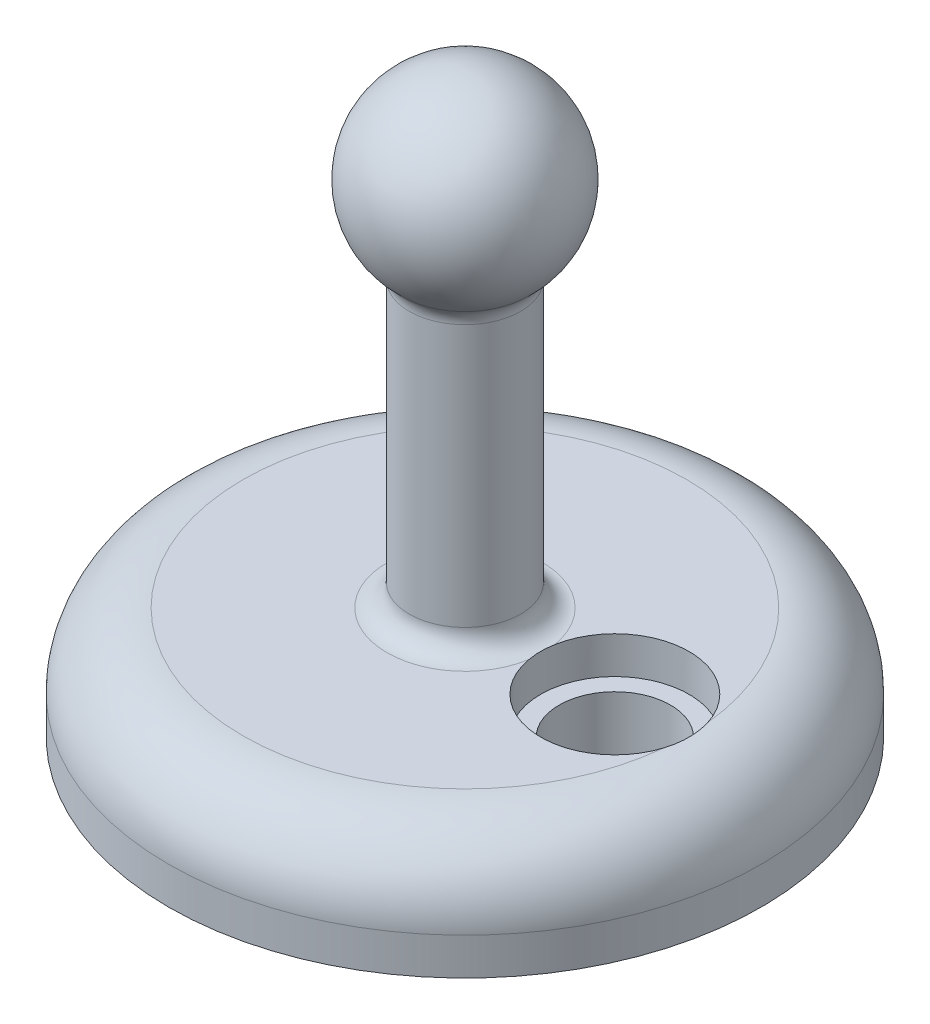
from build123d import *

# Parameters (mm, degrees)
SKETCH1_R               = 39.901069585
BOSS_EXTRUDE1_DEPTH     = 15
FILLET1_R               = 10
SKETCH2_R               = 1.75
CUT_EXTRUDE1_DEPTH      = 10
FILLET2_R               = 1
SKETCH3_R               = 2.5
CUT_EXTRUDE2_DEPTH      = 6
SKETCH4_R               = 7.5
BOSS_EXTRUDE2_DEPTH     = 50
FILLET3_R               = 3
CUT_EXTRUDE4_DEPTH      = 10
CUT_EXTRUDE4_DEPTH_BACK = 15
SKETCH6_R               = 7.5
CUT_EXTRUDE5_DEPTH      = 5
CUT_EXTRUDE5_DEPTH_BACK = 5
SKETCH7_R               = 10
SKETCH8_W               = 1.346153846
SKETCH8_H               = 0.358974359
SKETCH8_W_2             = 0.314102565
SKETCH8_H_2             = 2.557692308
CUT_EXTRUDE6_DEPTH      = 1


with BuildPart() as part:
    # Sketch1 → Boss-Extrude1 (new body)
    with BuildSketch(Plane(origin=(0, 0, 0), x_dir=(1, 0, 0), z_dir=(0, 1, 0))):
        with Locations(Location((0, 0, 0), (0, 0, 270))):
            Circle(SKETCH1_R)
    extrude(amount=BOSS_EXTRUDE1_DEPTH)

    # Fillet1
    fillet1_edges = [part.edges().sort_by_distance(p)[0] for p in [
        (0, 15, -39.901069585),
    ]]
    fillet(fillet1_edges, radius=FILLET1_R)

    # Sketch2 → Cut-Extrude1 (cut)
    with BuildSketch(Plane.XZ):
        with Locations(Location((-16.5, 28.578838325, 0), (0, 0, 270))):
            Circle(SKETCH2_R)
        with Locations(Location((16.5, 28.578838325, 0), (0, 0, 270))):
            Circle(SKETCH2_R)
        with Locations(Location((33, 0, 0), (0, 0, 270))):
            Circle(SKETCH2_R)
        with Locations(Location((16.5, -28.578838325, 0), (0, 0, 270))):
            Circle(SKETCH2_R)
        with Locations(Location((-16.5, -28.578838325, 0), (0, 0, 270))):
            Circle(SKETCH2_R)
        with Locations(Location((-33, 0, 0), (0, 0, 270))):
            Circle(SKETCH2_R)
    extrude(amount=-CUT_EXTRUDE1_DEPTH, mode=Mode.SUBTRACT)

    # Fillet2
    fillet2_edges = [part.edges().sort_by_distance(p)[0] for p in [
        (-16.5, 10, 30.328838325),
        (-33, 10, 1.75),
        (-16.5, 10, -26.828838325),
        (16.5, 10, -26.828838325),
        (33, 10, 1.75),
        (16.5, 10, 30.328838325),
    ]]
    fillet(fillet2_edges, radius=FILLET2_R)

    # Sketch3 → Cut-Extrude2 (cut)
    with BuildSketch(Plane.XZ):
        with Locations(Location((-16.5, 28.578838325, 0), (0, 0, 270))):
            Circle(SKETCH3_R)
        with Locations(Location((-33, 0, 0), (0, 0, 270))):
            Circle(SKETCH3_R)
        with Locations(Location((-16.5, -28.578838325, 0), (0, 0, 270))):
            Circle(SKETCH3_R)
        with Locations(Location((16.5, -28.578838325, 0), (0, 0, 270))):
            Circle(SKETCH3_R)
        with Locations(Location((33, 0, 0), (0, 0, 270))):
            Circle(SKETCH3_R)
        with Locations(Location((16.5, 28.578838325, 0), (0, 0, 270))):
            Circle(SKETCH3_R)
    extrude(amount=-CUT_EXTRUDE2_DEPTH, mode=Mode.SUBTRACT)

    # Sketch4 → Boss-Extrude2 (add)
    with BuildSketch(Plane(origin=(0, 15, 0), x_dir=(1, 0, 0), z_dir=(0, 1, 0))):
        with Locations(Location((0, 0, 0), (0, 0, 270))):
            Circle(SKETCH4_R)
    extrude(amount=BOSS_EXTRUDE2_DEPTH)

    # Sketch5 → Revolve1 (revolve)
    with BuildSketch(Plane.XY):
        with BuildLine():
            Line((0, 77.7), (0, 52.3))
            ThreePointArc((0, 52.3), (12.7, 65), (0, 77.7))
        make_face()
    revolve(axis=Axis((0, 77.7, 0), (0, -1, 0)))

    # Fillet3
    fillet3_edges = [part.edges().sort_by_distance(p)[0] for p in [
        (0, 15, -7.5),
        (-5.303300859, 54.75109762, -5.303300859),
    ]]
    fillet(fillet3_edges, radius=FILLET3_R)

    # Sketch6 → Cut-Extrude4 (cut, two sides: drawn at the far end of the back side and taken through both)
    with BuildSketch(Plane(origin=(0, 15, 0), x_dir=(1, 0, 0), z_dir=(0, 1, 0)).offset(-CUT_EXTRUDE4_DEPTH_BACK)):
        with Locations(Location((20.200534793, 0, 0), (0, 0, 270))):
            Circle(SKETCH6_R)
    extrude(amount=CUT_EXTRUDE4_DEPTH + CUT_EXTRUDE4_DEPTH_BACK, mode=Mode.SUBTRACT)

    # Sketch7 → Cut-Extrude5 (cut, two sides: drawn at the far end of the back side and taken through both)
    with BuildSketch(Plane(origin=(0, 15, 0), x_dir=(1, 0, 0), z_dir=(0, 1, 0)).offset(-CUT_EXTRUDE5_DEPTH_BACK)):
        with Locations(Location((20.200534793, 0, 0), (0, 0, 17.166550599))):
            Circle(SKETCH7_R)
    extrude(amount=CUT_EXTRUDE5_DEPTH + CUT_EXTRUDE5_DEPTH_BACK, mode=Mode.SUBTRACT)

    # Sketch8 → Cut-Extrude6 (cut)
    # profile 1 of 27: a face of its own
    with BuildSketch(Plane.XZ):
        with BuildLine():
            Line((6.626332559, 20.161559811), (7.312730796, 20.161559811))
            add(Edge.make_bspline(
                [(7.312730796, 20.161559811), (7.359941702, 20.161507915), (7.450399895, 20.161408479), (7.580114951, 20.158393734), (7.697924682, 20.154367041), (7.803575063, 20.148785148), (7.897391161, 20.142188558), (7.978948461, 20.132936519), (8.048888017, 20.123276223), (8.090794467, 20.113454817), (8.109906277, 20.108975676)],
                knots=[0, 0, 0, 0, 1.415646017, 2.712440637, 3.8905458, 4.950247383, 5.884950622, 6.709939814, 7.411656543, 8, 8, 8, 8], degree=3))
            add(Edge.make_bspline(
                [(8.109906277, 20.108975676), (8.134099811, 20.102353727), (8.181916788, 20.089265865), (8.250817831, 20.063052141), (8.316371677, 20.031969976), (8.378803235, 19.996546036), (8.437345318, 19.955260472), (8.492871359, 19.909786855), (8.544891339, 19.859075286), (8.593112731, 19.803694546), (8.637397529, 19.744574336), (8.675527211, 19.680832106), (8.707454439, 19.613540803), (8.73483771, 19.542747232), (8.754546164, 19.467856908), (8.769393064, 19.389390196), (8.778816692, 19.307355506), (8.779719254, 19.251295638), (8.780178713, 19.222757728)],
                knots=[0, 0, 0, 0, 0.999701418, 1.975846123, 2.934577507, 3.890451536, 4.834027766, 5.787354733, 6.749476667, 7.726910423, 8.712836071, 9.690891519, 10.682875813, 11.679750201, 12.712814741, 13.765529915, 14.8625177, 16, 16, 16, 16], degree=3))
            add(Edge.make_bspline(
                [(8.780178713, 19.222757728), (8.779757288, 19.193979951), (8.778932742, 19.137674287), (8.769036457, 19.055301499), (8.755706265, 18.976583109), (8.735209213, 18.901693658), (8.70836354, 18.831077888), (8.676871487, 18.763656656), (8.638887957, 18.700576984), (8.595243127, 18.641609866), (8.546691532, 18.586699954), (8.493438594, 18.536245159), (8.435699302, 18.490540821), (8.373657154, 18.449484477), (8.306707305, 18.414028198), (8.235865151, 18.382270893), (8.160514935, 18.355599832), (8.108372421, 18.341569771), (8.081861405, 18.334436414)],
                knots=[0, 0, 0, 0, 1.121902311, 2.195077645, 3.232258892, 4.234102512, 5.217864754, 6.176164875, 7.132989551, 8.084763148, 9.034132444, 9.988522005, 10.94243251, 11.903244335, 12.886203696, 13.894208494, 14.929344452, 16, 16, 16, 16], degree=3))
            add(Edge.make_bspline(
                [(8.081861405, 18.334436414), (8.059934071, 18.329773433), (8.011879044, 18.319554238), (7.932736322, 18.308145782), (7.840590936, 18.298408181), (7.735568656, 18.291107043), (7.617763751, 18.284856675), (7.487112494, 18.279888581), (7.343358416, 18.277158727), (7.243087172, 18.277017934), (7.190735604, 18.276944426)],
                knots=[0, 0, 0, 0, 0.601384939, 1.31797006, 2.144135048, 3.087295005, 4.142315834, 5.309527816, 6.595305764, 8, 8, 8, 8], degree=3))
            Line((7.190735604, 18.276944426), (6.940435123, 18.276944426))
            Line((6.940435123, 18.276944426), (6.940435123, 16.661559811))
            Line((6.940435123, 16.661559811), (6.626332559, 16.661559811))
            Line((6.626332559, 16.661559811), (6.626332559, 20.161559811))
        make_face()
        with BuildLine():
            Line((6.940435123, 19.802585452), (6.940435123, 18.635918785))
            Line((6.940435123, 18.635918785), (7.553215572, 18.628206446))
            add(Edge.make_bspline(
                [(7.553215572, 18.628206446), (7.583135498, 18.628190982), (7.640895298, 18.62816113), (7.724331521, 18.632146353), (7.801740808, 18.636746886), (7.872885383, 18.64348281), (7.937797318, 18.653004067), (7.996584847, 18.662615805), (8.04879213, 18.676521168), (8.109891331, 18.695244237), (8.177974679, 18.727176852), (8.252042227, 18.773526742), (8.314812814, 18.832607451), (8.369131111, 18.899035282), (8.412236989, 18.972934411), (8.443792981, 19.052003348), (8.462334138, 19.135431198), (8.464820332, 19.192519336), (8.466076149, 19.221355484)],
                knots=[0, 0, 0, 0, 1.160613943, 2.240541288, 3.23993089, 4.169200891, 5.011653406, 5.7853311, 6.478053781, 7.106038997, 8.262395093, 9.384106736, 10.481365981, 11.59014053, 12.70357646, 13.786202915, 14.881775077, 16, 16, 16, 16], degree=3))
            add(Edge.make_bspline(
                [(8.466076149, 19.221355484), (8.464813502, 19.249493998), (8.462303517, 19.30542988), (8.443647654, 19.38740864), (8.41229834, 19.465644345), (8.368841746, 19.53861743), (8.316100616, 19.604806234), (8.254801273, 19.662303361), (8.185088011, 19.708525064), (8.12023978, 19.738358346), (8.062638594, 19.756573621), (8.012606634, 19.769318461), (7.95611596, 19.779494068), (7.89314818, 19.78773357), (7.824191347, 19.794787032), (7.748653032, 19.799573009), (7.666819388, 19.802374465), (7.610008817, 19.80251342), (7.580559322, 19.802585452)],
                knots=[0, 0, 0, 0, 1.120700087, 2.227813068, 3.331159281, 4.466773991, 5.599788987, 6.693661531, 7.80175334, 8.91857717, 9.525282508, 10.207424825, 10.974604443, 11.810962634, 12.737642355, 13.736264703, 14.826523623, 16, 16, 16, 16], degree=3))
            Line((7.580559322, 19.802585452), (6.940435123, 19.802585452))
        make_face(mode=Mode.SUBTRACT)
    # profile 2 of 27: a face of its own
    with BuildSketch(Plane.XZ):
        with BuildLine():
            Line((3.485306918, 20.161559811), (3.799409482, 20.161559811))
            Line((3.799409482, 20.161559811), (3.799409482, 18.064504523))
            add(Edge.make_bspline(
                [(3.799409482, 18.064504523), (3.799362738, 18.034823787), (3.799274033, 17.978499476), (3.799866547, 17.898331175), (3.801525916, 17.827058716), (3.802572075, 17.764407369), (3.804899409, 17.710664621), (3.806797456, 17.665539311), (3.809238012, 17.629245108), (3.81217113, 17.608064182), (3.813431918, 17.598959651)],
                knots=[0, 0, 0, 0, 1.528628734, 2.90083645, 4.128790002, 5.200304208, 6.127813768, 6.898992206, 7.526736466, 8, 8, 8, 8], degree=3))
            add(Edge.make_bspline(
                [(3.813431918, 17.598959651), (3.818609377, 17.566112887), (3.828672563, 17.502270158), (3.854318941, 17.411361876), (3.890136442, 17.329430418), (3.932579485, 17.253919127), (3.988512096, 17.186929767), (4.055515631, 17.125218114), (4.1366934, 17.07124631), (4.226954005, 17.021895498), (4.324239243, 16.982230415), (4.423650509, 16.952237051), (4.523693488, 16.933958151), (4.590669654, 16.931841612), (4.623928713, 16.93079058)],
                knots=[0, 0, 0, 0, 1.035780045, 2.013197591, 2.933192213, 3.817615948, 4.702609284, 5.640816605, 6.646850145, 7.73207398, 8.84249596, 9.914020372, 10.964143139, 12, 12, 12, 12], degree=3))
            add(Edge.make_bspline(
                [(4.623928713, 16.93079058), (4.652482453, 16.931864431), (4.709425015, 16.934005929), (4.794031446, 16.94726736), (4.876431554, 16.971167926), (4.957032234, 17.002007684), (5.032583219, 17.042755275), (5.103126661, 17.089826115), (5.166090595, 17.145036991), (5.223548593, 17.206137335), (5.273583529, 17.275077135), (5.31695467, 17.350355273), (5.3524806, 17.43310462), (5.370024125, 17.491259042), (5.379036886, 17.521135132)],
                knots=[0, 0, 0, 0, 0.994687771, 1.983630487, 2.973142513, 3.978332533, 4.983357753, 5.956394766, 6.925816176, 7.893390482, 8.871859704, 9.88551698, 10.913711441, 12, 12, 12, 12], degree=3))
            add(Edge.make_bspline(
                [(5.379036886, 17.521135132), (5.382037011, 17.533483706), (5.388722499, 17.561001306), (5.394969544, 17.607522597), (5.40147607, 17.662411961), (5.40599064, 17.726063773), (5.41039186, 17.798264746), (5.413024933, 17.879391003), (5.414241966, 17.969147964), (5.414604646, 18.031785126), (5.414794097, 18.064504523)],
                knots=[0, 0, 0, 0, 0.558680831, 1.244966039, 2.062412453, 2.990489873, 4.051219941, 5.244515665, 6.560634259, 8, 8, 8, 8], degree=3))
            Line((5.414794097, 18.064504523), (5.414794097, 20.161559811))
            Line((5.414794097, 20.161559811), (5.728896662, 20.161559811))
            Line((5.728896662, 20.161559811), (5.728896662, 18.0476776))
            add(Edge.make_bspline(
                [(5.728896662, 18.0476776), (5.728642541, 18.009579221), (5.72814661, 17.935227918), (5.723846033, 17.826276559), (5.716989033, 17.722923577), (5.707300945, 17.625155081), (5.694463942, 17.533320922), (5.680188722, 17.446616153), (5.662009189, 17.365663161), (5.640775788, 17.289830743), (5.61650224, 17.21764523), (5.585061091, 17.149136615), (5.549636591, 17.082222215), (5.507621938, 17.017914107), (5.460410556, 16.955927553), (5.406958875, 16.896638478), (5.349034714, 16.839099432), (5.285675154, 16.784786366), (5.217924629, 16.734977689), (5.145984672, 16.691179918), (5.070407902, 16.654156301), (4.991390776, 16.623680376), (4.908899573, 16.600765777), (4.822932213, 16.583690621), (4.73329302, 16.573988324), (4.672328364, 16.572546394), (4.641456758, 16.571816221)],
                knots=[0, 0, 0, 0, 1.316592851, 2.569410997, 3.76748051, 4.895814652, 5.963796859, 6.97159953, 7.931736103, 8.829262218, 9.692595152, 10.560224239, 11.431080259, 12.30701507, 13.211635791, 14.121146779, 15.063487852, 16.031507147, 17.00238618, 17.966455255, 18.938106653, 19.907068911, 20.888905087, 21.893141452, 22.933117798, 24, 24, 24, 24], degree=3))
            add(Edge.make_bspline(
                [(4.641456758, 16.571816221), (4.607787655, 16.572600987), (4.541728996, 16.574140693), (4.444390929, 16.582963443), (4.351076733, 16.599581838), (4.260800856, 16.620741781), (4.174792358, 16.649925519), (4.091898914, 16.684023644), (4.013540233, 16.725900904), (3.938445104, 16.772494297), (3.868620348, 16.824918935), (3.804522945, 16.882059109), (3.746047075, 16.942999486), (3.694178378, 17.008399852), (3.648057494, 17.077751559), (3.60832728, 17.151250799), (3.574214036, 17.228869115), (3.556607469, 17.282822316), (3.547706758, 17.310097471)],
                knots=[0, 0, 0, 0, 1.13879206, 2.234305948, 3.301075583, 4.341971843, 5.366689343, 6.369221514, 7.369726634, 8.367512178, 9.355451585, 10.318319045, 11.268648973, 12.207971039, 13.137398894, 14.081662264, 15.030215811, 16, 16, 16, 16], degree=3))
            add(Edge.make_bspline(
                [(3.547706758, 17.310097471), (3.5425296, 17.328730046), (3.531300228, 17.369144515), (3.519274931, 17.436031003), (3.509165849, 17.513045921), (3.499660291, 17.600194539), (3.494051333, 17.697544406), (3.489133894, 17.805053322), (3.485272275, 17.922851283), (3.485295048, 18.004905799), (3.485306918, 18.0476776)],
                knots=[0, 0, 0, 0, 0.625038921, 1.35572334, 2.194682327, 3.136881307, 4.189498639, 5.346923369, 6.617055217, 8, 8, 8, 8], degree=3))
            Line((3.485306918, 18.0476776), (3.485306918, 20.161559811))
        make_face()
    # profile 3 of 27: a face of its own
    with BuildSketch(Plane.XZ):
        Polygon((1.286588969, 20.161559811), (1.555819738, 20.161559811), (2.722486405, 17.514123914), (2.383844578, 17.514123914), (1.421204354, 19.698118305), (0.458564129, 17.514123914), (0.119922303, 17.514123914), align=None)
    # profile 4 of 27: a face of its own
    with BuildSketch(Plane.XZ):
        with BuildLine():
            Line((6.940435123, 12.251303401), (6.626332559, 12.251303401))
            add(Edge.make_bspline(
                [(6.626332559, 12.251303401), (6.628379712, 12.292974289), (6.632400266, 12.374814803), (6.651228555, 12.49413871), (6.678169432, 12.608193508), (6.716260886, 12.716063422), (6.763567164, 12.81870223), (6.820297192, 12.915702245), (6.887491042, 13.006693434), (6.963697776, 13.090832277), (7.046466415, 13.168019848), (7.135772355, 13.234675091), (7.229617382, 13.290992762), (7.327716781, 13.338074004), (7.431177345, 13.37341385), (7.539060202, 13.39963549), (7.651839339, 13.415411835), (7.728679361, 13.417107621), (7.767758841, 13.417970068)],
                knots=[0, 0, 0, 0, 1.10065271, 2.161652631, 3.183658789, 4.190468796, 5.17591951, 6.163126047, 7.15150782, 8.156236427, 9.156009102, 10.134482811, 11.092018607, 12.041330605, 13.001268258, 13.972401359, 14.968799086, 16, 16, 16, 16], degree=3))
            add(Edge.make_bspline(
                [(7.767758841, 13.417970068), (7.806136915, 13.417071611), (7.88154846, 13.415306176), (7.991610474, 13.400145147), (8.096387769, 13.376399555), (8.195675535, 13.343084139), (8.2886816, 13.298299712), (8.376104644, 13.244502173), (8.458985455, 13.182282342), (8.533592239, 13.109028528), (8.602100318, 13.030826144), (8.661202573, 12.94733824), (8.711815737, 12.861108954), (8.754003416, 12.771480753), (8.785059555, 12.677609724), (8.808637763, 12.580862522), (8.821965177, 12.480237711), (8.824010601, 12.412131155), (8.825050508, 12.377505324)],
                knots=[0, 0, 0, 0, 1.111607364, 2.184268762, 3.212621178, 4.221274766, 5.211760367, 6.196651075, 7.1921475, 8.207485113, 9.220403448, 10.201281604, 11.166441695, 12.114753415, 13.065576456, 14.026450734, 14.996634279, 16, 16, 16, 16], degree=3))
            add(Edge.make_bspline(
                [(8.825050508, 12.377505324), (8.823357245, 12.328757489), (8.820000433, 12.232117276), (8.791286057, 12.090102413), (8.746439546, 11.952508994), (8.692442189, 11.841771692), (8.637969745, 11.752538198), (8.588882237, 11.679069493), (8.531417426, 11.599964025), (8.464738928, 11.515486687), (8.390226056, 11.424975782), (8.307203893, 11.328485987), (8.215080411, 11.227014217), (8.15042191, 11.157708616), (8.116917495, 11.121796189)],
                knots=[0, 0, 0, 0, 1.184426356, 2.348067706, 3.509069118, 4.696110526, 5.333549288, 6.050745305, 6.844228056, 7.710549037, 8.667450064, 9.695053472, 10.805634456, 12, 12, 12, 12], degree=3))
            Line((8.116917495, 11.121796189), (7.241216373, 10.187200837))
            Line((7.241216373, 10.187200837), (8.869922303, 10.187200837))
            Line((8.869922303, 10.187200837), (8.869922303, 9.828226478))
            Line((8.869922303, 9.828226478), (6.491717174, 9.828226478))
            Line((6.491717174, 9.828226478), (7.849088969, 11.276744106))
            add(Edge.make_bspline(
                [(7.849088969, 11.276744106), (7.882136856, 11.311242413), (7.945615083, 11.377506599), (8.03539766, 11.474249559), (8.116036648, 11.5639991), (8.188054041, 11.646585648), (8.249887546, 11.723217216), (8.304759778, 11.79141192), (8.348725369, 11.85416637), (8.396440765, 11.926906984), (8.442654746, 12.015719301), (8.482367102, 12.12425299), (8.506581951, 12.235980243), (8.509486786, 12.31148228), (8.510947944, 12.349460452)],
                knots=[0, 0, 0, 0, 1.329631726, 2.553950428, 3.673215718, 4.687767853, 5.603093632, 6.413772471, 7.123043292, 7.734684054, 8.834405432, 9.900288307, 10.943827018, 12, 12, 12, 12], degree=3))
            add(Edge.make_bspline(
                [(8.510947944, 12.349460452), (8.510312201, 12.373341851), (8.509059275, 12.420407501), (8.498001578, 12.48941326), (8.481291072, 12.555978074), (8.457345814, 12.620306693), (8.425739074, 12.681752345), (8.387265694, 12.740389825), (8.34287563, 12.79707879), (8.291524361, 12.850232088), (8.235112841, 12.898913294), (8.175518592, 12.942037379), (8.112468487, 12.97807649), (8.046228365, 13.007619987), (7.976982896, 13.030795368), (7.904598151, 13.046853948), (7.829274134, 13.056936432), (7.777840639, 13.058300604), (7.75163304, 13.058995709)],
                knots=[0, 0, 0, 0, 0.991446411, 1.95395049, 2.89581595, 3.838931463, 4.798493298, 5.75982156, 6.748411868, 7.785213223, 8.824556874, 9.840280684, 10.836137867, 11.835679398, 12.848801643, 13.863922112, 14.911575587, 16, 16, 16, 16], degree=3))
            add(Edge.make_bspline(
                [(7.75163304, 13.058995709), (7.724262207, 13.058280676), (7.670510411, 13.056876471), (7.591591378, 13.047053807), (7.5163056, 13.030107967), (7.444463697, 13.006931292), (7.375944112, 12.977472743), (7.311080068, 12.940780999), (7.250017178, 12.896997506), (7.192640655, 12.847356949), (7.139776676, 12.792089348), (7.0933298, 12.730479385), (7.052745786, 12.66365197), (7.017336552, 12.591787419), (6.988580862, 12.514233639), (6.966607712, 12.431265934), (6.949220865, 12.343244553), (6.943412345, 12.282459468), (6.940435123, 12.251303401)],
                knots=[0, 0, 0, 0, 1.031018746, 2.02475058, 2.990194455, 3.934040569, 4.864654155, 5.795059489, 6.735614925, 7.690564532, 8.649604399, 9.611025574, 10.590972636, 11.591080095, 12.624614302, 13.701020113, 14.821632451, 16, 16, 16, 16], degree=3))
        make_face()
    # profile 5 of 27: a face of its own
    with BuildSketch(Plane.XZ):
        Polygon((3.171204354, 13.328226478), (3.507742815, 13.328226478), (4.674409482, 10.570013337), (5.841076149, 13.328226478), (6.17761461, 13.328226478), (4.696845379, 9.828226478), (4.651973585, 9.828226478), align=None)
    # profile 6 of 27: a face of its own
    with BuildSketch(Plane.XZ):
        Polygon((0.703255636, 13.417970068), (1.0173582, 13.417970068), (1.0173582, 12.385918785), (1.466076149, 12.385918785), (1.466076149, 12.071816221), (1.0173582, 12.071816221), (1.0173582, 9.828226478), (0.703255636, 9.828226478), (0.703255636, 12.071816221), (0.254537687, 12.071816221), (0.254537687, 12.385918785), (0.703255636, 12.385918785), align=None)
    # profile 7 of 27: a face of its own
    with BuildSketch(Plane.XZ):
        with BuildLine():
            Line((-2.617257185, 12.385918785), (-2.303154621, 12.385918785))
            Line((-2.303154621, 12.385918785), (-2.303154621, 11.199620709))
            add(Edge.make_bspline(
                [(-2.303154621, 11.199620709), (-2.303012716, 11.164797959), (-2.302741258, 11.098183671), (-2.300900317, 11.002328485), (-2.296570224, 10.914911772), (-2.291156399, 10.835883035), (-2.284194263, 10.765255644), (-2.275910902, 10.703276287), (-2.266652481, 10.649242102), (-2.257589767, 10.616698747), (-2.253374973, 10.601563818)],
                knots=[0, 0, 0, 0, 1.388932606, 2.656963016, 3.823490214, 4.879454478, 5.816252168, 6.653371382, 7.373723809, 8, 8, 8, 8], degree=3))
            add(Edge.make_bspline(
                [(-2.253374973, 10.601563818), (-2.246613518, 10.582540947), (-2.233231177, 10.544890685), (-2.208957693, 10.49050168), (-2.178929357, 10.440126398), (-2.146069529, 10.391822325), (-2.108170121, 10.347020338), (-2.06571065, 10.305796095), (-2.020112413, 10.266592003), (-1.95235739, 10.220207211), (-1.859698124, 10.170491881), (-1.738045368, 10.127596063), (-1.606141143, 10.101960243), (-1.514976423, 10.098985988), (-1.468118563, 10.097457247)],
                knots=[0, 0, 0, 0, 0.725840625, 1.436591201, 2.137033971, 2.831655856, 3.53531722, 4.242432219, 4.957935707, 5.694543706, 7.190802206, 8.724350549, 10.316345118, 12, 12, 12, 12], degree=3))
            add(Edge.make_bspline(
                [(-1.468118563, 10.097457247), (-1.421265055, 10.099018496), (-1.330612187, 10.102039223), (-1.200157218, 10.126822761), (-1.080905803, 10.16822845), (-0.974054852, 10.226035862), (-0.880089012, 10.296777925), (-0.801784593, 10.379786734), (-0.737177338, 10.472436121), (-0.708967918, 10.541560399), (-0.694781223, 10.576323433)],
                knots=[0, 0, 0, 0, 1.157059328, 2.238695713, 3.266970494, 4.264342957, 5.228770407, 6.160125903, 7.074715775, 8, 8, 8, 8], degree=3))
            add(Edge.make_bspline(
                [(-0.694781223, 10.576323433), (-0.690586993, 10.590289732), (-0.681314575, 10.621165807), (-0.671352223, 10.673545555), (-0.662377762, 10.73601016), (-0.654714585, 10.808968369), (-0.649249423, 10.892229521), (-0.646303396, 10.985767597), (-0.642975121, 11.089288957), (-0.642924605, 11.161756717), (-0.64289821, 11.199620709)],
                knots=[0, 0, 0, 0, 0.557542046, 1.232589297, 2.036731608, 2.971723315, 4.038036528, 5.22795436, 6.551621927, 8, 8, 8, 8], degree=3))
            Line((-0.64289821, 11.199620709), (-0.64289821, 12.385918785))
            Line((-0.64289821, 12.385918785), (-0.328795646, 12.385918785))
            Line((-0.328795646, 12.385918785), (-0.328795646, 11.140726478))
            add(Edge.make_bspline(
                [(-0.328795646, 11.140726478), (-0.329237341, 11.098419306), (-0.330094289, 11.016337606), (-0.335601633, 10.897053495), (-0.345051245, 10.78589125), (-0.35939393, 10.68279203), (-0.376259605, 10.587834548), (-0.398015878, 10.500897102), (-0.423994116, 10.422247549), (-0.453299631, 10.350505772), (-0.487921498, 10.285458877), (-0.524748519, 10.223723061), (-0.567273291, 10.166830126), (-0.612043525, 10.111947988), (-0.661845181, 10.061806461), (-0.71574504, 10.015254985), (-0.77298446, 9.971581953), (-0.834833658, 9.932490674), (-0.90038972, 9.897274029), (-0.969733578, 9.866057951), (-1.043714576, 9.841355373), (-1.121378213, 9.820044708), (-1.203104992, 9.803330239), (-1.288816125, 9.791543672), (-1.378482741, 9.784318341), (-1.439592201, 9.783681296), (-1.47092305, 9.783354683)],
                knots=[0, 0, 0, 0, 1.493040784, 2.896703357, 4.213163133, 5.428574705, 6.569057535, 7.615249723, 8.588095153, 9.490268104, 10.346124644, 11.18633936, 12.024365274, 12.850166724, 13.684164916, 14.514361689, 15.362232829, 16.222528818, 17.093394965, 17.986930858, 18.902426812, 19.842810585, 20.827885679, 21.843828298, 22.894529745, 24, 24, 24, 24], degree=3))
            add(Edge.make_bspline(
                [(-1.47092305, 9.783354683), (-1.502019564, 9.78369439), (-1.563127109, 9.784361946), (-1.652798353, 9.791503754), (-1.73874696, 9.803311925), (-1.820667358, 9.820167142), (-1.898641756, 9.841206212), (-1.972985995, 9.866209747), (-2.042829558, 9.897290229), (-2.109011562, 9.932267787), (-2.171013951, 9.971833062), (-2.229122529, 10.015201102), (-2.283259381, 10.062307165), (-2.333436449, 10.112954522), (-2.378949426, 10.167771458), (-2.420365468, 10.226317018), (-2.458322173, 10.288011107), (-2.492674963, 10.35407427), (-2.522186719, 10.426646279), (-2.548241964, 10.506943376), (-2.569552603, 10.595845893), (-2.586895071, 10.693277822), (-2.600846512, 10.798772863), (-2.610532654, 10.912941279), (-2.615948485, 11.035504971), (-2.616811546, 11.120154861), (-2.617257185, 11.163863497)],
                knots=[0, 0, 0, 0, 1.083640291, 2.129454052, 3.13281866, 4.105697902, 5.042300162, 5.946461698, 6.836384745, 7.703652036, 8.553297018, 9.397182691, 10.228592656, 11.052265423, 11.879314572, 12.708807002, 13.549817954, 14.402308542, 15.300838682, 16.27712199, 17.341985831, 18.484375296, 19.725102775, 21.0496083, 22.476576903, 24, 24, 24, 24], degree=3))
            Line((-2.617257185, 11.163863497), (-2.617257185, 12.385918785))
        make_face()
    # profile 8 of 27: a face of its own
    with BuildSketch(Plane.XZ):
        with BuildLine():
            Line((-5.533923851, 12.385918785), (-5.219821287, 12.385918785))
            Line((-5.219821287, 12.385918785), (-5.219821287, 11.924580644))
            add(Edge.make_bspline(
                [(-5.219821287, 11.924580644), (-5.186283652, 11.966423367), (-5.121202701, 12.047620631), (-5.012818368, 12.154341205), (-4.898274467, 12.24228643), (-4.778272464, 12.312390224), (-4.652649454, 12.36523685), (-4.522171184, 12.403402782), (-4.386056478, 12.42628761), (-4.293492041, 12.42927784), (-4.246664236, 12.43079058)],
                knots=[0, 0, 0, 0, 1.12780773, 2.188550248, 3.19190651, 4.159438251, 5.104880172, 6.052711206, 7.014878035, 8, 8, 8, 8], degree=3))
            add(Edge.make_bspline(
                [(-4.246664236, 12.43079058), (-4.199333602, 12.429045385), (-4.106696134, 12.425629616), (-3.971818073, 12.398612925), (-3.845844679, 12.35246767), (-3.729225123, 12.2892556), (-3.62409791, 12.210649126), (-3.531773058, 12.119071345), (-3.455409811, 12.013735261), (-3.404212448, 11.916012105), (-3.3704868, 11.829323311), (-3.349254463, 11.755076561), (-3.331223481, 11.67235841), (-3.315591733, 11.581418821), (-3.305014621, 11.48162063), (-3.29667233, 11.373372938), (-3.290693636, 11.256710808), (-3.290456429, 11.17602418), (-3.290334108, 11.134416382)],
                knots=[0, 0, 0, 0, 1.235846778, 2.418850247, 3.575807741, 4.728682307, 5.871620074, 6.994088408, 8.11269785, 9.256955736, 9.865816715, 10.540099792, 11.271859618, 12.076849838, 12.949306005, 13.892391288, 14.913166135, 16, 16, 16, 16], degree=3))
            Line((-3.290334108, 11.134416382), (-3.290334108, 9.828226478))
            Line((-3.290334108, 9.828226478), (-3.604436672, 9.828226478))
            Line((-3.604436672, 9.828226478), (-3.604436672, 11.031351478))
            add(Edge.make_bspline(
                [(-3.604436672, 11.031351478), (-3.60462988, 11.066173923), (-3.604999454, 11.132783333), (-3.606165101, 11.228152357), (-3.608974907, 11.314638935), (-3.61292322, 11.392036302), (-3.618702251, 11.460270139), (-3.624724882, 11.519479416), (-3.632089859, 11.569588958), (-3.638652772, 11.599754041), (-3.641596127, 11.613282568)],
                knots=[0, 0, 0, 0, 1.430800155, 2.736877192, 3.918605307, 4.986035426, 5.920637409, 6.731861385, 7.431261377, 8, 8, 8, 8], degree=3))
            add(Edge.make_bspline(
                [(-3.641596127, 11.613282568), (-3.652221658, 11.652993752), (-3.672672519, 11.729425497), (-3.723206502, 11.83309985), (-3.787020683, 11.921298038), (-3.864918532, 11.993474759), (-3.956147608, 12.049645596), (-4.060454751, 12.088619551), (-4.176833391, 12.11299582), (-4.258687774, 12.115422952), (-4.301351736, 12.116688016)],
                knots=[0, 0, 0, 0, 1.084156227, 2.086665306, 3.027808233, 3.945421172, 4.874247719, 5.839848303, 6.874090471, 8, 8, 8, 8], degree=3))
            add(Edge.make_bspline(
                [(-4.301351736, 12.116688016), (-4.326619419, 12.116212012), (-4.376623512, 12.115270011), (-4.450773484, 12.105818713), (-4.522697658, 12.090360257), (-4.593117867, 12.06949162), (-4.66062566, 12.04082935), (-4.727389951, 12.00829998), (-4.790896716, 11.967751768), (-4.852500113, 11.922561147), (-4.90981292, 11.872481939), (-4.963141259, 11.819637429), (-5.010679279, 11.763361825), (-5.053747954, 11.704561878), (-5.090926218, 11.64243004), (-5.123379306, 11.577565733), (-5.150915001, 11.509883585), (-5.164597693, 11.462908523), (-5.171443883, 11.439404362)],
                knots=[0, 0, 0, 0, 1.023777757, 2.026029729, 3.023749952, 4.003683103, 4.997618607, 5.993177895, 7.010360494, 8.046726602, 9.087585522, 10.09234134, 11.086953743, 12.070360549, 13.043493632, 14.017870808, 15.008233677, 16, 16, 16, 16], degree=3))
            add(Edge.make_bspline(
                [(-5.171443883, 11.439404362), (-5.175383532, 11.422149159), (-5.183959941, 11.384585485), (-5.193223121, 11.322941066), (-5.201630696, 11.251631091), (-5.208667655, 11.170738773), (-5.212973071, 11.079980898), (-5.217667468, 10.979745061), (-5.219376529, 10.869631572), (-5.219668883, 10.792969879), (-5.219821287, 10.753006125)],
                knots=[0, 0, 0, 0, 0.615963638, 1.340920617, 2.168419149, 3.115676021, 4.16674242, 5.331190069, 6.6087489, 8, 8, 8, 8], degree=3))
            Line((-5.219821287, 10.753006125), (-5.219821287, 9.828226478))
            Line((-5.219821287, 9.828226478), (-5.533923851, 9.828226478))
            Line((-5.533923851, 9.828226478), (-5.533923851, 12.385918785))
        make_face()
    # profile 9 of 27: a face of its own
    with BuildSketch(Plane.XZ):
        with BuildLine():
            add(Edge.make_bspline(
                [(-7.484444685, 12.43079058), (-7.436453412, 12.429768689), (-7.342354254, 12.42776501), (-7.204546368, 12.406350045), (-7.073001232, 12.37360268), (-6.94721504, 12.328331118), (-6.828798745, 12.267649168), (-6.716027501, 12.195239877), (-6.609210492, 12.109457283), (-6.545187463, 12.043099215), (-6.512689877, 12.009416382)],
                knots=[0, 0, 0, 0, 1.054011418, 2.066658804, 3.057071809, 4.030435133, 4.997543892, 5.974964718, 6.972108034, 8, 8, 8, 8], degree=3))
            add(Edge.make_bspline(
                [(-6.512689877, 12.009416382), (-6.484707923, 11.977202396), (-6.429285543, 11.913397854), (-6.358219824, 11.809942241), (-6.296998264, 11.70280214), (-6.247935303, 11.590554813), (-6.209250279, 11.474180142), (-6.181784583, 11.353278131), (-6.165447648, 11.228115784), (-6.163244681, 11.143111946), (-6.162128979, 11.100061414)],
                knots=[0, 0, 0, 0, 1.025258237, 2.030674902, 3.01204498, 3.988269485, 4.97094183, 5.956517959, 6.965070386, 8, 8, 8, 8], degree=3))
            add(Edge.make_bspline(
                [(-6.162128979, 11.100061414), (-6.163110317, 11.056761356), (-6.165049485, 10.971198423), (-6.183393101, 10.845179057), (-6.211924187, 10.722984234), (-6.252756026, 10.60512554), (-6.305114135, 10.491242713), (-6.369004822, 10.381833164), (-6.444876439, 10.27668103), (-6.530880436, 10.176679192), (-6.625932312, 10.084512977), (-6.729048461, 10.004184708), (-6.838202494, 9.935363183), (-6.954845848, 9.879926768), (-7.077913335, 9.836217068), (-7.207670403, 9.805517051), (-7.343915473, 9.786955367), (-7.436942694, 9.784571794), (-7.484444685, 9.783354683)],
                knots=[0, 0, 0, 0, 0.998656419, 1.973391657, 2.932242238, 3.890759089, 4.846373663, 5.82037756, 6.809684879, 7.83454468, 8.860553229, 9.859544525, 10.845671541, 11.83227036, 12.833544569, 13.85385346, 14.904124723, 16, 16, 16, 16], degree=3))
            add(Edge.make_bspline(
                [(-7.484444685, 9.783354683), (-7.532179404, 9.784575879), (-7.625670264, 9.786967654), (-7.762396246, 9.805444936), (-7.892385865, 9.836202919), (-8.015614463, 9.880070412), (-8.13275931, 9.935364955), (-8.242545807, 10.003976645), (-8.345745723, 10.0845368), (-8.440817707, 10.176672737), (-8.526816312, 10.276682694), (-8.602689321, 10.381832732), (-8.666579647, 10.491242825), (-8.718937851, 10.60512551), (-8.759769664, 10.722984242), (-8.788300756, 10.845179055), (-8.806644371, 10.971198423), (-8.808583539, 11.056761356), (-8.809564877, 11.100061414)],
                knots=[0, 0, 0, 0, 1.099876186, 2.154163076, 3.173186993, 4.173200201, 5.163417411, 6.152872554, 7.150605724, 8.17532212, 9.198891216, 10.186952605, 11.159729845, 12.11414092, 13.071450619, 14.029093627, 15.002601286, 16, 16, 16, 16], degree=3))
            add(Edge.make_bspline(
                [(-8.809564877, 11.100061414), (-8.808441567, 11.14287796), (-8.806217605, 11.227647362), (-8.789897096, 11.352574423), (-8.76253854, 11.473271812), (-8.723807143, 11.589197288), (-8.674291952, 11.700952724), (-8.613930664, 11.808357555), (-8.542140032, 11.911345355), (-8.48693808, 11.975067435), (-8.459003979, 12.007313016)],
                knots=[0, 0, 0, 0, 1.031353054, 2.041901799, 3.029428768, 4.008703097, 4.981709435, 5.96992636, 6.972712378, 8, 8, 8, 8], degree=3))
            add(Edge.make_bspline(
                [(-8.459003979, 12.007313016), (-8.426555388, 12.041287955), (-8.362739525, 12.108105652), (-8.255390797, 12.193638176), (-8.142896976, 12.26755425), (-8.02317205, 12.327030465), (-7.897489192, 12.373868983), (-7.765269949, 12.406434498), (-7.626994434, 12.427687853), (-7.532434813, 12.429746031), (-7.484444685, 12.43079058)],
                knots=[0, 0, 0, 0, 1.027980169, 2.021703884, 2.998553061, 3.971491411, 4.943284454, 5.930300938, 6.949603206, 8, 8, 8, 8], degree=3))
        make_face()
        with BuildLine():
            add(Edge.make_bspline(
                [(-7.485846928, 12.116688016), (-7.51978454, 12.115723425), (-7.586783668, 12.113819142), (-7.685403253, 12.099335237), (-7.780343407, 12.076387733), (-7.871784251, 12.043783677), (-7.959417423, 12.001684778), (-8.043326826, 11.949976418), (-8.123759266, 11.889343461), (-8.199141329, 11.81988079), (-8.268323641, 11.744001795), (-8.328801618, 11.663153436), (-8.380226724, 11.57864709), (-8.423066883, 11.490394879), (-8.454974071, 11.397502465), (-8.478147094, 11.301021834), (-8.492617334, 11.200756417), (-8.494503713, 11.132595399), (-8.495462313, 11.097958048)],
                knots=[0, 0, 0, 0, 1.021534396, 2.016698045, 2.994645724, 3.958388632, 4.93408049, 5.916473867, 6.921342795, 7.962252576, 8.998418191, 10.008913653, 10.997312074, 11.973003931, 12.956656626, 13.948281152, 14.957379055, 16, 16, 16, 16], degree=3))
            add(Edge.make_bspline(
                [(-8.495462313, 11.097958048), (-8.493855489, 11.053206021), (-8.490666245, 10.964381616), (-8.464731008, 10.833570493), (-8.421344728, 10.707988641), (-8.362757449, 10.588372255), (-8.28935123, 10.477699977), (-8.202864163, 10.379028492), (-8.104224463, 10.293842681), (-7.994607963, 10.223161835), (-7.876253645, 10.16700208), (-7.750997324, 10.127203104), (-7.62035663, 10.101331412), (-7.531075899, 10.098759937), (-7.485846928, 10.097457247)],
                knots=[0, 0, 0, 0, 1.016792936, 2.018143844, 3.017858371, 4.030088057, 5.03801393, 6.028138512, 7.003788237, 7.991172063, 8.984598303, 9.972568034, 10.972917682, 12, 12, 12, 12], degree=3))
            add(Edge.make_bspline(
                [(-7.485846928, 10.097457247), (-7.440620559, 10.098767527), (-7.351344963, 10.101353984), (-7.220885786, 10.127072804), (-7.095971815, 10.167176465), (-6.977740427, 10.223098674), (-6.868173824, 10.294111089), (-6.768824702, 10.378547466), (-6.683076091, 10.477961318), (-6.609742486, 10.588518846), (-6.550195744, 10.707803199), (-6.507012542, 10.833593671), (-6.481014956, 10.964375713), (-6.477834127, 11.053204043), (-6.476231544, 11.097958048)],
                knots=[0, 0, 0, 0, 1.02726834, 2.027799167, 3.010890988, 4.004497153, 4.992059811, 5.971914811, 6.958719428, 7.966827853, 8.981595046, 9.981490638, 10.983022906, 12, 12, 12, 12], degree=3))
            add(Edge.make_bspline(
                [(-6.476231544, 11.097958048), (-6.477189814, 11.132595606), (-6.479075543, 11.200757032), (-6.493550507, 11.301019485), (-6.516706047, 11.397511082), (-6.548677664, 11.490363085), (-6.591331678, 11.578875589), (-6.643748471, 11.662905317), (-6.703979496, 11.744281863), (-6.773996617, 11.819635503), (-6.849299995, 11.88937054), (-6.929765033, 11.949999929), (-7.013550012, 12.001457525), (-7.100928595, 12.044143765), (-7.192381162, 12.076091106), (-7.287188291, 12.099467737), (-7.385387101, 12.113757934), (-7.452146144, 12.115705075), (-7.485846928, 12.116688016)],
                knots=[0, 0, 0, 0, 1.042956736, 2.052379634, 3.044323526, 4.02829302, 5.004299113, 5.996692471, 7.007513377, 8.048758398, 9.090003419, 10.095195979, 11.07790575, 12.047570684, 13.018257071, 13.989683339, 14.985167495, 16, 16, 16, 16], degree=3))
        make_face(mode=Mode.SUBTRACT)
    # profile 10 of 27: a face of its own
    with BuildSketch(Plane.XZ):
        with BuildLine():
            Line((-13.251872569, 12.385918785), (-12.937770005, 12.385918785))
            Line((-12.937770005, 12.385918785), (-12.937770005, 11.941407568))
            add(Edge.make_bspline(
                [(-12.937770005, 11.941407568), (-12.909486055, 11.980295169), (-12.855291296, 12.054807542), (-12.766425643, 12.152997827), (-12.677649531, 12.236325981), (-12.613716149, 12.280068853), (-12.583002377, 12.301083048)],
                knots=[0, 0, 0, 0, 1.134379233, 2.173579362, 3.122582517, 4, 4, 4, 4], degree=3))
            add(Edge.make_bspline(
                [(-12.583002377, 12.301083048), (-12.541137715, 12.321088414), (-12.458139815, 12.360749627), (-12.32672059, 12.400983186), (-12.192245921, 12.425708287), (-12.101437707, 12.429089661), (-12.055758787, 12.43079058)],
                knots=[0, 0, 0, 0, 1.014936303, 2.012140481, 3.000054389, 4, 4, 4, 4], degree=3))
            add(Edge.make_bspline(
                [(-12.055758787, 12.43079058), (-12.024865791, 12.42974529), (-11.963730212, 12.427676715), (-11.873146121, 12.41421668), (-11.78528751, 12.390950507), (-11.70067348, 12.358543183), (-11.620952801, 12.319296496), (-11.547863603, 12.273246788), (-11.482239395, 12.221549713), (-11.424113344, 12.16187078), (-11.371844318, 12.092534181), (-11.323765472, 12.011669932), (-11.279340259, 11.917462271), (-11.254718951, 11.84909573), (-11.241756383, 11.813102279)],
                knots=[0, 0, 0, 0, 1.009824226, 1.998387844, 2.986035974, 3.974953746, 4.955485308, 5.885931332, 6.793869504, 7.679848016, 8.601185859, 9.625726857, 10.749998409, 12, 12, 12, 12], degree=3))
            add(Edge.make_bspline(
                [(-11.241756383, 11.813102279), (-11.228045132, 11.837826698), (-11.201063315, 11.886480883), (-11.155757678, 11.955339146), (-11.108289881, 12.019745937), (-11.058255388, 12.079752362), (-11.005830801, 12.135062092), (-10.950769401, 12.185857994), (-10.89338462, 12.232358207), (-10.81359238, 12.286681367), (-10.709779772, 12.344382548), (-10.578891658, 12.394410992), (-10.442741486, 12.425327121), (-10.350323788, 12.428957394), (-10.303655422, 12.43079058)],
                knots=[0, 0, 0, 0, 0.86119277, 1.694706429, 2.50939023, 3.298075842, 4.073795165, 4.829715201, 5.57930267, 6.321991688, 7.768977793, 9.186738141, 10.579381044, 12, 12, 12, 12], degree=3))
            add(Edge.make_bspline(
                [(-10.303655422, 12.43079058), (-10.260773959, 12.429173359), (-10.176850773, 12.426008301), (-10.054673507, 12.401154828), (-9.940731702, 12.358477181), (-9.835254626, 12.300243544), (-9.740094812, 12.227064361), (-9.657378503, 12.139995523), (-9.58760814, 12.0396529), (-9.5420295, 11.945260912), (-9.511114236, 11.861925579), (-9.492053001, 11.790919287), (-9.475213306, 11.712767734), (-9.461232061, 11.627377473), (-9.451013509, 11.534446865), (-9.443442793, 11.434127989), (-9.43831872, 11.326342877), (-9.437956648, 11.251977377), (-9.437770005, 11.213643144)],
                knots=[0, 0, 0, 0, 1.209669288, 2.367440248, 3.500751976, 4.631527125, 5.755587489, 6.87532382, 8.007944318, 9.190864318, 9.82315674, 10.514484317, 11.263564316, 12.079023757, 12.955305781, 13.901327259, 14.918167583, 16, 16, 16, 16], degree=3))
            Line((-9.437770005, 11.213643144), (-9.437770005, 9.828226478))
            Line((-9.437770005, 9.828226478), (-9.751872569, 9.828226478))
            Line((-9.751872569, 9.828226478), (-9.751872569, 11.215045388))
            add(Edge.make_bspline(
                [(-9.751872569, 11.215045388), (-9.751950452, 11.247765962), (-9.752100131, 11.310649929), (-9.754793763, 11.40090238), (-9.759869077, 11.483170737), (-9.765803716, 11.557342825), (-9.774047525, 11.623591614), (-9.784693457, 11.681784032), (-9.795971137, 11.732377844), (-9.814707128, 11.788463891), (-9.84465502, 11.850334102), (-9.8902725, 11.917057678), (-9.947742606, 11.975138478), (-10.014102762, 12.025556795), (-10.089651207, 12.066550436), (-10.17291593, 12.095826446), (-10.263379982, 12.113949324), (-10.32600277, 12.115755339), (-10.358342922, 12.116688016)],
                knots=[0, 0, 0, 0, 1.253487763, 2.409012846, 3.458416907, 4.410876679, 5.259312806, 6.014470957, 6.676830364, 7.243083969, 8.276244668, 9.299465089, 10.325150304, 11.392391894, 12.482080715, 13.603491619, 14.762376348, 16, 16, 16, 16], degree=3))
            add(Edge.make_bspline(
                [(-10.358342922, 12.116688016), (-10.398012876, 12.115271859), (-10.476415787, 12.112472993), (-10.590861274, 12.08389912), (-10.70083229, 12.04081887), (-10.803047423, 11.978386413), (-10.897075214, 11.903578049), (-10.977974791, 11.814628453), (-11.044806977, 11.713998526), (-11.090060953, 11.620851824), (-11.118650254, 11.53718238), (-11.13752717, 11.464085008), (-11.152210562, 11.38100344), (-11.165981091, 11.288495949), (-11.174968819, 11.185925769), (-11.183137191, 11.073767368), (-11.186958054, 10.951683408), (-11.187492513, 10.86705672), (-11.187770005, 10.823118305)],
                knots=[0, 0, 0, 0, 1.090531906, 2.155305635, 3.229839962, 4.33261226, 5.44038871, 6.529323825, 7.629011124, 8.757537029, 9.370236727, 10.061839251, 10.834451254, 11.692844982, 12.636905849, 13.66920014, 14.789842145, 16, 16, 16, 16], degree=3))
            Line((-11.187770005, 10.823118305), (-11.187770005, 9.828226478))
            Line((-11.187770005, 9.828226478), (-11.501872569, 9.828226478))
            Line((-11.501872569, 9.828226478), (-11.501872569, 11.128807407))
            add(Edge.make_bspline(
                [(-11.501872569, 11.128807407), (-11.501952, 11.165500726), (-11.502104817, 11.236094983), (-11.504781135, 11.337328659), (-11.509867756, 11.429409739), (-11.515748305, 11.512231202), (-11.524208483, 11.585642531), (-11.533818245, 11.650037289), (-11.545166856, 11.70525404), (-11.563956741, 11.765817425), (-11.592671209, 11.832538348), (-11.638859471, 11.903679369), (-11.696467051, 11.965947467), (-11.764037927, 12.019106215), (-11.840043609, 12.063047697), (-11.92402701, 12.094707448), (-12.015231923, 12.113131738), (-12.078109629, 12.115480235), (-12.110446287, 12.116688016)],
                knots=[0, 0, 0, 0, 1.320475261, 2.540461679, 3.643808994, 4.639130445, 5.527981419, 6.302341397, 6.981980563, 7.553956391, 8.582137848, 9.585246428, 10.591171744, 11.620968678, 12.668337649, 13.738356861, 14.836885341, 16, 16, 16, 16], degree=3))
            add(Edge.make_bspline(
                [(-12.110446287, 12.116688016), (-12.148462499, 12.115157556), (-12.224227458, 12.112107404), (-12.335529428, 12.08465313), (-12.443015111, 12.041649055), (-12.54496981, 11.981989236), (-12.638643958, 11.908090157), (-12.720652226, 11.821175262), (-12.789594751, 11.722326228), (-12.835326566, 11.630161712), (-12.86482504, 11.548588437), (-12.884420375, 11.479237489), (-12.901260001, 11.402237241), (-12.913774022, 11.31735013), (-12.925854438, 11.225129036), (-12.931684747, 11.125114546), (-12.937356309, 11.017392458), (-12.937628724, 10.943019913), (-12.937770005, 10.904448433)],
                knots=[0, 0, 0, 0, 1.098833095, 2.189935336, 3.297829714, 4.440610912, 5.596351641, 6.740013378, 7.886572111, 9.072425424, 9.705826452, 10.395263256, 11.156850408, 11.985370555, 12.878090359, 13.847760091, 14.883794034, 16, 16, 16, 16], degree=3))
            Line((-12.937770005, 10.904448433), (-12.937770005, 9.828226478))
            Line((-12.937770005, 9.828226478), (-13.251872569, 9.828226478))
            Line((-13.251872569, 9.828226478), (-13.251872569, 12.385918785))
        make_face()
    # profile 11 of 27: a face of its own
    with BuildSketch(Plane.XZ):
        with BuildLine():
            Line((-14.293739556, 10.635918785), (-14.014693082, 10.48938433))
            add(Edge.make_bspline(
                [(-14.014693082, 10.48938433), (-14.036929677, 10.449940999), (-14.080193286, 10.373199896), (-14.154594034, 10.267768036), (-14.232586106, 10.17292032), (-14.317690074, 10.091190666), (-14.407359753, 10.019939281), (-14.502092408, 9.957601456), (-14.602381226, 9.904482936), (-14.70823095, 9.859730408), (-14.820530502, 9.825320914), (-14.939552018, 9.801016693), (-15.065523513, 9.785993424), (-15.151869693, 9.784248283), (-15.196083306, 9.783354683)],
                knots=[0, 0, 0, 0, 1.120438281, 2.179929193, 3.190490725, 4.156257408, 5.095198341, 6.022838206, 6.959905092, 7.901321166, 8.864066838, 9.862729781, 10.905609505, 12, 12, 12, 12], degree=3))
            add(Edge.make_bspline(
                [(-15.196083306, 9.783354683), (-15.245225284, 9.784501858), (-15.341087046, 9.786739665), (-15.480626793, 9.806032129), (-15.612006211, 9.837504488), (-15.735217914, 9.88147003), (-15.849960167, 9.938897354), (-15.956461022, 10.008856835), (-16.055280548, 10.09098909), (-16.143304757, 10.186005534), (-16.22254864, 10.287687491), (-16.29247446, 10.393643375), (-16.350931891, 10.5036066), (-16.398484501, 10.616877124), (-16.436889366, 10.732741017), (-16.46365607, 10.852252485), (-16.479085818, 10.975088069), (-16.481450263, 11.058185405), (-16.4826418, 11.100061414)],
                knots=[0, 0, 0, 0, 1.145258523, 2.234067595, 3.276747158, 4.290159414, 5.277019952, 6.260822364, 7.254936242, 8.264827045, 9.274100331, 10.257902744, 11.220704747, 12.172965371, 13.118907548, 14.062713208, 15.023725156, 16, 16, 16, 16], degree=3))
            add(Edge.make_bspline(
                [(-16.4826418, 11.100061414), (-16.481582659, 11.139356244), (-16.47948358, 11.217233409), (-16.466252793, 11.332498953), (-16.4428045, 11.444527406), (-16.410628176, 11.553411854), (-16.36907693, 11.658969988), (-16.318244711, 11.761266051), (-16.258052333, 11.860191191), (-16.211579659, 11.922594325), (-16.188170646, 11.95402776)],
                knots=[0, 0, 0, 0, 1.024358464, 2.0301432, 3.019427413, 4.004406732, 4.986367066, 5.972626655, 6.978780325, 8, 8, 8, 8], degree=3))
            add(Edge.make_bspline(
                [(-16.188170646, 11.95402776), (-16.156462963, 11.99189663), (-16.094052017, 12.06643478), (-15.988495661, 12.164373106), (-15.874195465, 12.246416881), (-15.752583839, 12.314424017), (-15.622247365, 12.366097664), (-15.484938074, 12.404605247), (-15.339092488, 12.426183258), (-15.239387267, 12.429231091), (-15.188370967, 12.43079058)],
                knots=[0, 0, 0, 0, 1.030682036, 2.02871468, 2.997146059, 3.962720338, 4.930598197, 5.918074684, 6.934738563, 8, 8, 8, 8], degree=3))
            add(Edge.make_bspline(
                [(-15.188370967, 12.43079058), (-15.135923361, 12.429436531), (-15.033033115, 12.426780196), (-14.883000994, 12.402153863), (-14.741040278, 12.363101308), (-14.607207774, 12.307947518), (-14.481489913, 12.236787966), (-14.364703863, 12.148646124), (-14.254852351, 12.046228037), (-14.190943772, 11.967464828), (-14.15842305, 11.927385132)],
                knots=[0, 0, 0, 0, 1.056321875, 2.072262726, 3.055038591, 4.01806755, 4.982017516, 5.957941055, 6.960871419, 8, 8, 8, 8], degree=3))
            add(Edge.make_bspline(
                [(-14.15842305, 11.927385132), (-14.136296112, 11.89718155), (-14.092189519, 11.836975432), (-14.036942419, 11.738804274), (-13.988985024, 11.63609368), (-13.950652063, 11.527183383), (-13.919612561, 11.413363803), (-13.897155743, 11.293821258), (-13.883986124, 11.168591347), (-13.881397427, 11.083264791), (-13.880077697, 11.039764939)],
                knots=[0, 0, 0, 0, 0.94817472, 1.890038105, 2.849395472, 3.817997239, 4.812318967, 5.836947057, 6.897266129, 8, 8, 8, 8], degree=3))
            Line((-13.880077697, 11.039764939), (-16.168539236, 11.039764939))
            add(Edge.make_bspline(
                [(-16.168539236, 11.039764939), (-16.166999629, 11.006064475), (-16.163972056, 10.939793871), (-16.149856912, 10.842823088), (-16.127608139, 10.750449746), (-16.096339076, 10.663366704), (-16.058472231, 10.580436577), (-16.012086514, 10.50227454), (-15.95674696, 10.42923661), (-15.895021261, 10.360669472), (-15.826314165, 10.299608711), (-15.754031418, 10.244956935), (-15.677137853, 10.199151338), (-15.59623977, 10.161971448), (-15.511467984, 10.132865132), (-15.422795789, 10.112997311), (-15.330397673, 10.099690204), (-15.267411939, 10.098210539), (-15.235346127, 10.097457247)],
                knots=[0, 0, 0, 0, 1.094153842, 2.151609401, 3.174256925, 4.172055639, 5.149267565, 6.128595816, 7.11444997, 8.118368179, 9.117203808, 10.09244225, 11.054858984, 12.015122123, 12.976791628, 13.957293641, 14.960065497, 16, 16, 16, 16], degree=3))
            add(Edge.make_bspline(
                [(-15.235346127, 10.097457247), (-15.203994979, 10.098065304), (-15.141788288, 10.099271805), (-15.049147431, 10.111003716), (-14.958007904, 10.129973991), (-14.86874692, 10.155863981), (-14.783176074, 10.187440833), (-14.703930524, 10.225543691), (-14.631050309, 10.267693438), (-14.562933342, 10.315903113), (-14.496862349, 10.3749113), (-14.431319862, 10.448547021), (-14.361043209, 10.535634549), (-14.317053616, 10.601180215), (-14.293739556, 10.635918785)],
                knots=[0, 0, 0, 0, 0.99110716, 1.966546729, 2.947904876, 3.932708344, 4.903319531, 5.828989031, 6.710028674, 7.56322171, 8.463672341, 9.504779593, 10.677557249, 12, 12, 12, 12], degree=3))
        make_face()
        with BuildLine():
            add(Edge.make_bspline(
                [(-14.194180262, 11.353867503), (-14.205676886, 11.395530377), (-14.227804188, 11.475717998), (-14.274040552, 11.586758888), (-14.326112093, 11.685446789), (-14.387733824, 11.771026422), (-14.45755255, 11.847029935), (-14.538197732, 11.91344852), (-14.628633626, 11.972865971), (-14.728392767, 12.023018471), (-14.834034552, 12.06570833), (-14.944640744, 12.094333445), (-15.057498531, 12.113942988), (-15.133832818, 12.115769096), (-15.172245165, 12.116688016)],
                knots=[0, 0, 0, 0, 1.154881502, 2.222775134, 3.210006277, 4.132804581, 5.035138423, 5.962687519, 6.919655026, 7.923214229, 8.944639381, 9.960483929, 10.97369054, 12, 12, 12, 12], degree=3))
            add(Edge.make_bspline(
                [(-15.172245165, 12.116688016), (-15.203594604, 12.116076345), (-15.265565853, 12.114867199), (-15.356866921, 12.103397069), (-15.44454662, 12.084437224), (-15.529251908, 12.058472268), (-15.609872776, 12.023863665), (-15.688067544, 11.983280439), (-15.761847941, 11.933738855), (-15.807989236, 11.89598), (-15.831299653, 11.876904362)],
                knots=[0, 0, 0, 0, 1.04873581, 2.073130211, 3.073294108, 4.04793562, 5.032784715, 6.005352987, 6.992311501, 8, 8, 8, 8], degree=3))
            add(Edge.make_bspline(
                [(-15.831299653, 11.876904362), (-15.847992935, 11.861810047), (-15.881776069, 11.831262831), (-15.92691659, 11.778633624), (-15.970137063, 11.721882062), (-16.009470716, 11.658836937), (-16.045548302, 11.590216158), (-16.079308279, 11.516598523), (-16.109694691, 11.437425393), (-16.126790801, 11.382252954), (-16.135586512, 11.353867503)],
                knots=[0, 0, 0, 0, 0.879870761, 1.780643979, 2.707998968, 3.669668524, 4.684282772, 5.740141944, 6.837334558, 8, 8, 8, 8], degree=3))
            Line((-16.135586512, 11.353867503), (-14.194180262, 11.353867503))
        make_face(mode=Mode.SUBTRACT)
    # profile 12 of 27: a face of its own
    with BuildSketch(Plane.XZ):
        with BuildLine():
            Line((-19.354436672, 12.385918785), (-19.040334108, 12.385918785))
            Line((-19.040334108, 12.385918785), (-19.040334108, 11.924580644))
            add(Edge.make_bspline(
                [(-19.040334108, 11.924580644), (-19.006796473, 11.966423367), (-18.941715522, 12.047620631), (-18.833331188, 12.154341205), (-18.718787288, 12.24228643), (-18.598785284, 12.312390224), (-18.473162274, 12.36523685), (-18.342684004, 12.403402782), (-18.206569298, 12.42628761), (-18.114004861, 12.42927784), (-18.067177056, 12.43079058)],
                knots=[0, 0, 0, 0, 1.12780773, 2.188550248, 3.19190651, 4.159438251, 5.104880172, 6.052711206, 7.014878035, 8, 8, 8, 8], degree=3))
            add(Edge.make_bspline(
                [(-18.067177056, 12.43079058), (-18.019846422, 12.429045385), (-17.927208955, 12.425629616), (-17.792330893, 12.398612925), (-17.666357499, 12.35246767), (-17.549737944, 12.2892556), (-17.44461073, 12.210649126), (-17.352285879, 12.119071345), (-17.275922631, 12.013735261), (-17.224725268, 11.916012105), (-17.190999621, 11.829323311), (-17.169767283, 11.755076561), (-17.151736302, 11.67235841), (-17.136104554, 11.581418821), (-17.125527442, 11.48162063), (-17.11718515, 11.373372938), (-17.111206456, 11.256710808), (-17.110969249, 11.17602418), (-17.110846928, 11.134416382)],
                knots=[0, 0, 0, 0, 1.235846778, 2.418850247, 3.575807741, 4.728682307, 5.871620074, 6.994088408, 8.11269785, 9.256955736, 9.865816715, 10.540099792, 11.271859618, 12.076849838, 12.949306005, 13.892391288, 14.913166135, 16, 16, 16, 16], degree=3))
            Line((-17.110846928, 11.134416382), (-17.110846928, 9.828226478))
            Line((-17.110846928, 9.828226478), (-17.424949492, 9.828226478))
            Line((-17.424949492, 9.828226478), (-17.424949492, 11.031351478))
            add(Edge.make_bspline(
                [(-17.424949492, 11.031351478), (-17.4251427, 11.066173923), (-17.425512274, 11.132783333), (-17.426677921, 11.228152357), (-17.429487728, 11.314638935), (-17.433436041, 11.392036302), (-17.439215071, 11.460270139), (-17.445237702, 11.519479416), (-17.452602679, 11.569588958), (-17.459165592, 11.599754041), (-17.462108947, 11.613282568)],
                knots=[0, 0, 0, 0, 1.430800155, 2.736877192, 3.918605307, 4.986035426, 5.920637409, 6.731861385, 7.431261377, 8, 8, 8, 8], degree=3))
            add(Edge.make_bspline(
                [(-17.462108947, 11.613282568), (-17.472734479, 11.652993752), (-17.49318534, 11.729425497), (-17.543719323, 11.83309985), (-17.607533504, 11.921298038), (-17.685431353, 11.993474759), (-17.776660429, 12.049645596), (-17.880967571, 12.088619551), (-17.997346212, 12.11299582), (-18.079200595, 12.115422952), (-18.121864556, 12.116688016)],
                knots=[0, 0, 0, 0, 1.084156227, 2.086665306, 3.027808233, 3.945421172, 4.874247719, 5.839848303, 6.874090471, 8, 8, 8, 8], degree=3))
            add(Edge.make_bspline(
                [(-18.121864556, 12.116688016), (-18.14713224, 12.116212012), (-18.197136333, 12.115270011), (-18.271286305, 12.105818713), (-18.343210478, 12.090360257), (-18.413630687, 12.06949162), (-18.481138481, 12.04082935), (-18.547902772, 12.00829998), (-18.611409536, 11.967751768), (-18.673012933, 11.922561147), (-18.730325741, 11.872481939), (-18.783654079, 11.819637429), (-18.8311921, 11.763361825), (-18.874260775, 11.704561878), (-18.911439038, 11.64243004), (-18.943892126, 11.577565733), (-18.971427821, 11.509883585), (-18.985110514, 11.462908523), (-18.991956704, 11.439404362)],
                knots=[0, 0, 0, 0, 1.023777757, 2.026029729, 3.023749952, 4.003683103, 4.997618607, 5.993177895, 7.010360494, 8.046726602, 9.087585522, 10.09234134, 11.086953743, 12.070360549, 13.043493632, 14.017870808, 15.008233677, 16, 16, 16, 16], degree=3))
            add(Edge.make_bspline(
                [(-18.991956704, 11.439404362), (-18.995896352, 11.422149159), (-19.004472761, 11.384585485), (-19.013735941, 11.322941066), (-19.022143517, 11.251631091), (-19.029180475, 11.170738773), (-19.033485892, 11.079980898), (-19.038180288, 10.979745061), (-19.039889349, 10.869631572), (-19.040181703, 10.792969879), (-19.040334108, 10.753006125)],
                knots=[0, 0, 0, 0, 0.615963638, 1.340920617, 2.168419149, 3.115676021, 4.16674242, 5.331190069, 6.6087489, 8, 8, 8, 8], degree=3))
            Line((-19.040334108, 10.753006125), (-19.040334108, 9.828226478))
            Line((-19.040334108, 9.828226478), (-19.354436672, 9.828226478))
            Line((-19.354436672, 9.828226478), (-19.354436672, 12.385918785))
        make_face()
    # profile 13 of 27: a face of its own
    with BuildSketch(Plane.XZ):
        with BuildLine():
            add(Edge.make_bspline(
                [(-21.304957505, 12.43079058), (-21.256966232, 12.429768689), (-21.162867075, 12.42776501), (-21.025059189, 12.406350045), (-20.893514053, 12.37360268), (-20.767727861, 12.328331118), (-20.649311565, 12.267649168), (-20.536540321, 12.195239877), (-20.429723312, 12.109457283), (-20.365700283, 12.043099215), (-20.333202697, 12.009416382)],
                knots=[0, 0, 0, 0, 1.054011418, 2.066658804, 3.057071809, 4.030435133, 4.997543892, 5.974964718, 6.972108034, 8, 8, 8, 8], degree=3))
            add(Edge.make_bspline(
                [(-20.333202697, 12.009416382), (-20.305220743, 11.977202396), (-20.249798363, 11.913397854), (-20.178732644, 11.809942241), (-20.117511084, 11.70280214), (-20.068448123, 11.590554813), (-20.0297631, 11.474180142), (-20.002297403, 11.353278131), (-19.985960468, 11.228115784), (-19.983757501, 11.143111946), (-19.9826418, 11.100061414)],
                knots=[0, 0, 0, 0, 1.025258237, 2.030674902, 3.01204498, 3.988269485, 4.97094183, 5.956517959, 6.965070386, 8, 8, 8, 8], degree=3))
            add(Edge.make_bspline(
                [(-19.9826418, 11.100061414), (-19.983623137, 11.056761356), (-19.985562306, 10.971198423), (-20.003905922, 10.845179057), (-20.032437008, 10.722984234), (-20.073268846, 10.60512554), (-20.125626955, 10.491242713), (-20.189517643, 10.381833164), (-20.26538926, 10.27668103), (-20.351393257, 10.176679192), (-20.446445133, 10.084512977), (-20.549561281, 10.004184708), (-20.658715315, 9.935363183), (-20.775358668, 9.879926768), (-20.898426155, 9.836217068), (-21.028183223, 9.805517051), (-21.164428294, 9.786955367), (-21.257455515, 9.784571794), (-21.304957505, 9.783354683)],
                knots=[0, 0, 0, 0, 0.998656419, 1.973391657, 2.932242238, 3.890759089, 4.846373663, 5.82037756, 6.809684879, 7.83454468, 8.860553229, 9.859544525, 10.845671541, 11.83227036, 12.833544569, 13.85385346, 14.904124723, 16, 16, 16, 16], degree=3))
            add(Edge.make_bspline(
                [(-21.304957505, 9.783354683), (-21.352692225, 9.784575879), (-21.446183084, 9.786967654), (-21.582909066, 9.805444936), (-21.712898685, 9.836202919), (-21.836127284, 9.880070412), (-21.953272131, 9.935364955), (-22.063058628, 10.003976645), (-22.166258543, 10.0845368), (-22.261330528, 10.176672737), (-22.347329133, 10.276682694), (-22.423202141, 10.381832732), (-22.487092467, 10.491242825), (-22.539450671, 10.60512551), (-22.580282484, 10.722984242), (-22.608813577, 10.845179055), (-22.627157191, 10.971198423), (-22.62909636, 11.056761356), (-22.630077697, 11.100061414)],
                knots=[0, 0, 0, 0, 1.099876186, 2.154163076, 3.173186993, 4.173200201, 5.163417411, 6.152872554, 7.150605724, 8.17532212, 9.198891216, 10.186952605, 11.159729845, 12.11414092, 13.071450619, 14.029093627, 15.002601286, 16, 16, 16, 16], degree=3))
            add(Edge.make_bspline(
                [(-22.630077697, 11.100061414), (-22.628954387, 11.14287796), (-22.626730426, 11.227647362), (-22.610409917, 11.352574423), (-22.58305136, 11.473271812), (-22.544319964, 11.589197288), (-22.494804773, 11.700952724), (-22.434443485, 11.808357555), (-22.362652852, 11.911345355), (-22.307450901, 11.975067435), (-22.2795168, 12.007313016)],
                knots=[0, 0, 0, 0, 1.031353054, 2.041901799, 3.029428768, 4.008703097, 4.981709435, 5.96992636, 6.972712378, 8, 8, 8, 8], degree=3))
            add(Edge.make_bspline(
                [(-22.2795168, 12.007313016), (-22.247068209, 12.041287955), (-22.183252345, 12.108105652), (-22.075903617, 12.193638176), (-21.963409796, 12.26755425), (-21.84368487, 12.327030465), (-21.718002012, 12.373868983), (-21.58578277, 12.406434498), (-21.447507254, 12.427687853), (-21.352947633, 12.429746031), (-21.304957505, 12.43079058)],
                knots=[0, 0, 0, 0, 1.027980169, 2.021703884, 2.998553061, 3.971491411, 4.943284454, 5.930300938, 6.949603206, 8, 8, 8, 8], degree=3))
        make_face()
        with BuildLine():
            add(Edge.make_bspline(
                [(-21.306359749, 12.116688016), (-21.34029736, 12.115723425), (-21.407296489, 12.113819142), (-21.505916073, 12.099335237), (-21.600856227, 12.076387733), (-21.692297071, 12.043783677), (-21.779930244, 12.001684778), (-21.863839646, 11.949976418), (-21.944272086, 11.889343461), (-22.01965415, 11.81988079), (-22.088836462, 11.744001795), (-22.149314438, 11.663153436), (-22.200739545, 11.57864709), (-22.243579704, 11.490394879), (-22.275486892, 11.397502465), (-22.298659914, 11.301021834), (-22.313130155, 11.200756417), (-22.315016533, 11.132595399), (-22.315975133, 11.097958048)],
                knots=[0, 0, 0, 0, 1.021534396, 2.016698045, 2.994645724, 3.958388632, 4.93408049, 5.916473867, 6.921342795, 7.962252576, 8.998418191, 10.008913653, 10.997312074, 11.973003931, 12.956656626, 13.948281152, 14.957379055, 16, 16, 16, 16], degree=3))
            add(Edge.make_bspline(
                [(-22.315975133, 11.097958048), (-22.31436831, 11.053206021), (-22.311179065, 10.964381616), (-22.285243829, 10.833570493), (-22.241857549, 10.707988641), (-22.183270269, 10.588372255), (-22.109864051, 10.477699977), (-22.023376984, 10.379028492), (-21.924737283, 10.293842681), (-21.815120783, 10.223161835), (-21.696766465, 10.16700208), (-21.571510144, 10.127203104), (-21.44086945, 10.101331412), (-21.351588719, 10.098759937), (-21.306359749, 10.097457247)],
                knots=[0, 0, 0, 0, 1.016792936, 2.018143844, 3.017858371, 4.030088057, 5.03801393, 6.028138512, 7.003788237, 7.991172063, 8.984598303, 9.972568034, 10.972917682, 12, 12, 12, 12], degree=3))
            add(Edge.make_bspline(
                [(-21.306359749, 10.097457247), (-21.26113338, 10.098767527), (-21.171857784, 10.101353984), (-21.041398607, 10.127072804), (-20.916484635, 10.167176465), (-20.798253248, 10.223098674), (-20.688686644, 10.294111089), (-20.589337523, 10.378547466), (-20.503588912, 10.477961318), (-20.430255307, 10.588518846), (-20.370708564, 10.707803199), (-20.327525362, 10.833593671), (-20.301527776, 10.964375713), (-20.298346948, 11.053204043), (-20.296744364, 11.097958048)],
                knots=[0, 0, 0, 0, 1.02726834, 2.027799167, 3.010890988, 4.004497153, 4.992059811, 5.971914811, 6.958719428, 7.966827853, 8.981595046, 9.981490638, 10.983022906, 12, 12, 12, 12], degree=3))
            add(Edge.make_bspline(
                [(-20.296744364, 11.097958048), (-20.297702634, 11.132595606), (-20.299588363, 11.200757032), (-20.314063328, 11.301019485), (-20.337218867, 11.397511082), (-20.369190485, 11.490363085), (-20.411844498, 11.578875589), (-20.464261291, 11.662905317), (-20.524492317, 11.744281863), (-20.594509438, 11.819635503), (-20.669812816, 11.88937054), (-20.750277854, 11.949999929), (-20.834062832, 12.001457525), (-20.921441415, 12.044143765), (-21.012893983, 12.076091106), (-21.107701112, 12.099467737), (-21.205899922, 12.113757934), (-21.272658965, 12.115705075), (-21.306359749, 12.116688016)],
                knots=[0, 0, 0, 0, 1.042956736, 2.052379634, 3.044323526, 4.02829302, 5.004299113, 5.996692471, 7.007513377, 8.048758398, 9.090003419, 10.095195979, 11.07790575, 12.047570684, 13.018257071, 13.989683339, 14.985167495, 16, 16, 16, 16], degree=3))
        make_face(mode=Mode.SUBTRACT)
    # profile 14 of 27: a face of its own
    with BuildSketch(Plane.XZ):
        with BuildLine():
            Line((-25.501872569, 13.417970068), (-25.187770005, 13.417970068))
            Line((-25.187770005, 13.417970068), (-25.187770005, 11.902845869))
            add(Edge.make_bspline(
                [(-25.187770005, 11.902845869), (-25.154052703, 11.944989851), (-25.088403389, 12.027046344), (-24.977907273, 12.134107534), (-24.864436401, 12.226906156), (-24.744071591, 12.300776613), (-24.619021071, 12.359133156), (-24.488757426, 12.400520803), (-24.353256455, 12.425971899), (-24.261231305, 12.429170317), (-24.214612954, 12.43079058)],
                knots=[0, 0, 0, 0, 1.125788106, 2.19196713, 3.20547328, 4.180437432, 5.132270164, 6.079753143, 7.027236121, 8, 8, 8, 8], degree=3))
            add(Edge.make_bspline(
                [(-24.214612954, 12.43079058), (-24.167282561, 12.42904515), (-24.074645566, 12.425628922), (-23.939764103, 12.398615541), (-23.813803228, 12.352458103), (-23.697137385, 12.289291078), (-23.592312688, 12.210618251), (-23.499462924, 12.119786728), (-23.423622125, 12.01451281), (-23.372023008, 11.917256556), (-23.3384496, 11.830717802), (-23.317197774, 11.75648129), (-23.299178576, 11.673759376), (-23.28347884, 11.582594644), (-23.273015258, 11.482549473), (-23.26461064, 11.374075218), (-23.258634186, 11.2571781), (-23.258402581, 11.176257851), (-23.258282826, 11.134416382)],
                knots=[0, 0, 0, 0, 1.235656852, 2.418478516, 3.575258207, 4.727955599, 5.870717718, 6.98870536, 8.107142894, 9.245821548, 9.854588956, 10.528768408, 11.260415777, 12.065282286, 12.943670737, 13.886611085, 14.907229059, 16, 16, 16, 16], degree=3))
            Line((-23.258282826, 11.134416382), (-23.258282826, 9.828226478))
            Line((-23.258282826, 9.828226478), (-23.57238539, 9.828226478))
            Line((-23.57238539, 9.828226478), (-23.57238539, 11.031351478))
            add(Edge.make_bspline(
                [(-23.57238539, 11.031351478), (-23.572575693, 11.066174147), (-23.57293971, 11.132783988), (-23.574143055, 11.228150096), (-23.57682927, 11.314646231), (-23.581170096, 11.391995182), (-23.585735404, 11.460304786), (-23.592018721, 11.51947584), (-23.599328955, 11.569589615), (-23.605897736, 11.599754244), (-23.608843723, 11.613282568)],
                knots=[0, 0, 0, 0, 1.430932559, 2.737130458, 3.918967929, 4.986496826, 5.920444988, 6.731744033, 7.431208747, 8, 8, 8, 8], degree=3))
            add(Edge.make_bspline(
                [(-23.608843723, 11.613282568), (-23.620267968, 11.652976831), (-23.642231013, 11.729288822), (-23.69327899, 11.832951232), (-23.757038001, 11.921335973), (-23.834885263, 11.993250261), (-23.925443627, 12.0496618), (-24.029303591, 12.088729582), (-24.145487659, 12.112977304), (-24.227339131, 12.115416608), (-24.270001576, 12.116688016)],
                knots=[0, 0, 0, 0, 1.090059168, 2.095632401, 3.037101401, 3.955032261, 4.878929692, 5.839099886, 6.873700383, 8, 8, 8, 8], degree=3))
            add(Edge.make_bspline(
                [(-24.270001576, 12.116688016), (-24.295269349, 12.11621219), (-24.345273619, 12.115270542), (-24.419422285, 12.105816643), (-24.491351348, 12.090367925), (-24.561753526, 12.069463386), (-24.629136724, 12.04101785), (-24.695465049, 12.00808766), (-24.758859258, 11.967779405), (-24.820445075, 11.922553638), (-24.877762608, 11.872483878), (-24.931089724, 11.819636923), (-24.978628064, 11.763361959), (-25.021696655, 11.704561843), (-25.05887494, 11.642430049), (-25.091328022, 11.577565731), (-25.118863719, 11.509883585), (-25.132546411, 11.462908524), (-25.139392601, 11.439404362)],
                knots=[0, 0, 0, 0, 1.024319606, 2.027102035, 3.025350316, 4.005802111, 5.00026367, 5.987881639, 7.005602596, 8.042517216, 9.083927026, 10.089214625, 11.084353441, 12.06828073, 13.041928858, 14.016821737, 15.00770877, 16, 16, 16, 16], degree=3))
            add(Edge.make_bspline(
                [(-25.139392601, 11.439404362), (-25.143332029, 11.422383411), (-25.151916525, 11.385292664), (-25.161231359, 11.32411834), (-25.169569155, 11.253031968), (-25.176617705, 11.172141368), (-25.180940791, 11.081150126), (-25.185599032, 10.980679167), (-25.187333046, 10.870099146), (-25.187619999, 10.793203639), (-25.187770005, 10.753006125)],
                knots=[0, 0, 0, 0, 0.607992626, 1.324890765, 2.152360218, 3.099583803, 4.150613268, 5.323148443, 6.60066238, 8, 8, 8, 8], degree=3))
            Line((-25.187770005, 10.753006125), (-25.187770005, 9.828226478))
            Line((-25.187770005, 9.828226478), (-25.501872569, 9.828226478))
            Line((-25.501872569, 9.828226478), (-25.501872569, 13.417970068))
        make_face()
    # profile 15 of 27: a face of its own
    with BuildSketch(Plane.XZ):
        with BuildLine():
            Line((-28.82238539, 12.385918785), (-28.508282826, 12.385918785))
            Line((-28.508282826, 12.385918785), (-28.508282826, 11.912661574))
            add(Edge.make_bspline(
                [(-28.508282826, 11.912661574), (-28.474925342, 11.955599308), (-28.410101747, 12.039040201), (-28.298376842, 12.147030329), (-28.180450033, 12.238105633), (-28.053286621, 12.309488166), (-27.918862931, 12.363308978), (-27.777730613, 12.403088428), (-27.628691848, 12.426529902), (-27.526795396, 12.429351563), (-27.4748293, 12.43079058)],
                knots=[0, 0, 0, 0, 1.0828784, 2.104357462, 3.088488658, 4.04616522, 5.001424249, 5.969181776, 6.964304535, 8, 8, 8, 8], degree=3))
            add(Edge.make_bspline(
                [(-27.4748293, 12.43079058), (-27.429437697, 12.429477401), (-27.339718808, 12.426881834), (-27.20765558, 12.40930878), (-27.080480196, 12.379191087), (-26.958912142, 12.335790172), (-26.841649077, 12.282134702), (-26.730426977, 12.214417666), (-26.623513421, 12.136011476), (-26.523597232, 12.045779325), (-26.431275865, 11.948151058), (-26.351429684, 11.843128754), (-26.282557779, 11.734166168), (-26.226887483, 11.619574076), (-26.183279135, 11.500254846), (-26.152264458, 11.375726405), (-26.133806814, 11.246450465), (-26.131330363, 11.158547744), (-26.130077697, 11.11408385)],
                knots=[0, 0, 0, 0, 1.041296284, 2.058176809, 3.050446431, 4.034000596, 5.01514041, 6.003636468, 7.015969324, 8.052561599, 9.08815499, 10.094063707, 11.074456064, 12.040834395, 13.011057502, 13.983766392, 14.980127149, 16, 16, 16, 16], degree=3))
            add(Edge.make_bspline(
                [(-26.130077697, 11.11408385), (-26.131303183, 11.068681541), (-26.133720017, 10.979141637), (-26.152465023, 10.847654539), (-26.182421897, 10.721167165), (-26.225480081, 10.599889902), (-26.281121569, 10.483906251), (-26.348826129, 10.373299855), (-26.428712596, 10.268106151), (-26.520013724, 10.169753251), (-26.61906666, 10.079153938), (-26.72494415, 9.999915869), (-26.836003075, 9.933374493), (-26.951675242, 9.877791534), (-27.072950881, 9.83589935), (-27.199264159, 9.805681549), (-27.330546305, 9.787047053), (-27.419847457, 9.784594911), (-27.465013595, 9.783354683)],
                knots=[0, 0, 0, 0, 1.038740735, 2.04854663, 3.033179607, 4.009277356, 4.987731542, 5.972001279, 6.972200261, 8.005528982, 9.039189865, 10.040446548, 11.026516639, 11.997840187, 12.972163198, 13.956796175, 14.96660207, 16, 16, 16, 16], degree=3))
            add(Edge.make_bspline(
                [(-27.465013595, 9.783354683), (-27.515841167, 9.784649491), (-27.616240523, 9.787207115), (-27.763038193, 9.813126525), (-27.904315045, 9.851863461), (-28.03850587, 9.908562455), (-28.166673682, 9.980817971), (-28.288093488, 10.068928177), (-28.403410241, 10.172708801), (-28.472818998, 10.251440618), (-28.508282826, 10.291667984)],
                knots=[0, 0, 0, 0, 1.014726462, 2.004382257, 2.969841629, 3.936926163, 4.907207904, 5.903978561, 6.929055279, 8, 8, 8, 8], degree=3))
            Line((-28.508282826, 10.291667984), (-28.508282826, 8.885918785))
            Line((-28.508282826, 8.885918785), (-28.82238539, 8.885918785))
            Line((-28.82238539, 8.885918785), (-28.82238539, 12.385918785))
        make_face()
        with BuildLine():
            add(Edge.make_bspline(
                [(-27.477633787, 12.116688016), (-27.51321335, 12.116047758), (-27.583260337, 12.114787255), (-27.685932556, 12.099813306), (-27.784827984, 12.078075565), (-27.878949936, 12.045163664), (-27.969200552, 12.004764851), (-28.054884717, 11.95428284), (-28.135942284, 11.894630834), (-28.212169315, 11.82695149), (-28.281032608, 11.752376802), (-28.341995536, 11.672788993), (-28.393202841, 11.588288853), (-28.435704862, 11.499663491), (-28.468048144, 11.406218206), (-28.491003864, 11.308485193), (-28.505434217, 11.206357481), (-28.507323154, 11.136801474), (-28.508282826, 11.101463657)],
                knots=[0, 0, 0, 0, 1.05670511, 2.080379991, 3.077984906, 4.06214886, 5.038337365, 6.01289324, 7.01187578, 8.025460281, 9.038092164, 10.024533457, 11.000252242, 11.969694649, 12.940728589, 13.933144304, 14.949937299, 16, 16, 16, 16], degree=3))
            add(Edge.make_bspline(
                [(-28.508282826, 11.101463657), (-28.50669197, 11.055075545), (-28.503575348, 10.964197304), (-28.47823798, 10.831413182), (-28.437002716, 10.705761526), (-28.378474002, 10.588300489), (-28.304526428, 10.480317654), (-28.215428271, 10.383627047), (-28.11198572, 10.298836456), (-27.995918529, 10.227415203), (-27.871496398, 10.169427136), (-27.741710486, 10.127912926), (-27.608345605, 10.102340698), (-27.518177285, 10.099093878), (-27.472725935, 10.097457247)],
                knots=[0, 0, 0, 0, 1.03728447, 2.032128127, 3.01272805, 3.987917167, 4.958271349, 5.931593992, 6.91984656, 7.941419022, 8.973179163, 9.983609215, 10.983593296, 12, 12, 12, 12], degree=3))
            add(Edge.make_bspline(
                [(-27.472725935, 10.097457247), (-27.428190167, 10.099013624), (-27.339794674, 10.102102752), (-27.209636552, 10.12884094), (-27.083145914, 10.169685964), (-26.962965741, 10.229245521), (-26.850142254, 10.302235579), (-26.7482607, 10.389795612), (-26.659253786, 10.491285555), (-26.583389431, 10.604294058), (-26.522257946, 10.725469442), (-26.476327706, 10.85085083), (-26.449819133, 10.979996253), (-26.446062344, 11.066993966), (-26.444180262, 11.110578241)],
                knots=[0, 0, 0, 0, 1.00104056, 1.986885549, 2.97790532, 3.984399681, 4.995088187, 5.994304198, 6.996462723, 8.023150851, 9.048424203, 10.043036403, 11.019596776, 12, 12, 12, 12], degree=3))
            add(Edge.make_bspline(
                [(-26.444180262, 11.110578241), (-26.445634995, 11.15443323), (-26.448533129, 11.241801533), (-26.477080167, 11.370564436), (-26.519980145, 11.496452412), (-26.582539197, 11.615972962), (-26.656740466, 11.728747045), (-26.746487463, 11.828300924), (-26.847103659, 11.915471597), (-26.959792823, 11.987487006), (-27.080733249, 12.044772501), (-27.208048165, 12.08665614), (-27.341091767, 12.11182989), (-27.431719422, 12.115054396), (-27.477633787, 12.116688016)],
                knots=[0, 0, 0, 0, 0.983928682, 1.960191568, 2.949917689, 3.96440592, 4.982380491, 5.975291189, 6.965713506, 7.964880129, 8.970154049, 9.96478489, 10.968906225, 12, 12, 12, 12], degree=3))
        make_face(mode=Mode.SUBTRACT)
    # profile 16 of 27: a face of its own
    with BuildSketch(Plane.XZ):
        Polygon((8.402274065, 6.584636734), (8.466076149, 6.584636734), (8.466076149, 4.161559811), (8.869922303, 4.161559811), (8.869922303, 3.802585452), (8.466076149, 3.802585452), (8.466076149, 2.994893144), (8.151973585, 2.994893144), (8.151973585, 3.802585452), (6.491717174, 3.802585452), align=None)
        Polygon((8.151973585, 4.161559811), (8.151973585, 5.681591862), (7.108704354, 4.161559811), align=None, mode=Mode.SUBTRACT)
    # profile 17 of 27: a face of its own
    with BuildSketch(Plane.XZ):
        Polygon((4.292999226, 6.584636734), (4.60710179, 6.584636734), (4.60710179, 4.509316221), (5.770963969, 5.552585452), (6.222486405, 5.552585452), (4.872125828, 4.341046991), (6.35710179, 2.994893144), (5.906280476, 2.994893144), (4.60710179, 4.173478882), (4.60710179, 2.994893144), (4.292999226, 2.994893144), align=None)
    # profile 18 of 27: a face of its own
    with BuildSketch(Plane.XZ):
        with BuildLine():
            Line((-0.239052056, 5.552585452), (0.075050508, 5.552585452))
            Line((0.075050508, 5.552585452), (0.075050508, 5.108074234))
            add(Edge.make_bspline(
                [(0.075050508, 5.108074234), (0.103334458, 5.146961836), (0.157529217, 5.221474209), (0.24639487, 5.319664493), (0.335170982, 5.402992648), (0.399104364, 5.446735519), (0.429818136, 5.467749715)],
                knots=[0, 0, 0, 0, 1.134379233, 2.173579362, 3.122582517, 4, 4, 4, 4], degree=3))
            add(Edge.make_bspline(
                [(0.429818136, 5.467749715), (0.471682798, 5.48775508), (0.554680698, 5.527416294), (0.686099923, 5.567649852), (0.820574592, 5.592374954), (0.911382806, 5.595756327), (0.957061726, 5.597457247)],
                knots=[0, 0, 0, 0, 1.014936303, 2.012140481, 3.000054389, 4, 4, 4, 4], degree=3))
            add(Edge.make_bspline(
                [(0.957061726, 5.597457247), (0.987954722, 5.596411956), (1.049090301, 5.594343382), (1.139674391, 5.580883347), (1.227533003, 5.557617174), (1.312147033, 5.52520985), (1.391867712, 5.485963163), (1.46495691, 5.439913455), (1.530581118, 5.38821638), (1.588707169, 5.328537447), (1.640976194, 5.259200848), (1.689055041, 5.178336599), (1.733480253, 5.084128938), (1.758101562, 5.015762397), (1.771064129, 4.979768946)],
                knots=[0, 0, 0, 0, 1.009824226, 1.998387844, 2.986035974, 3.974953746, 4.955485308, 5.885931332, 6.793869504, 7.679848016, 8.601185859, 9.625726857, 10.749998409, 12, 12, 12, 12], degree=3))
            add(Edge.make_bspline(
                [(1.771064129, 4.979768946), (1.784775381, 5.004493365), (1.811757198, 5.05314755), (1.857062835, 5.122005812), (1.904530632, 5.186412604), (1.954565125, 5.246419028), (2.006989711, 5.301728759), (2.062051112, 5.35252466), (2.119435893, 5.399024874), (2.199228133, 5.453348034), (2.30304074, 5.511049215), (2.433928855, 5.561077659), (2.570079027, 5.591993787), (2.662496725, 5.59562406), (2.709165091, 5.597457247)],
                knots=[0, 0, 0, 0, 0.86119277, 1.694706429, 2.50939023, 3.298075842, 4.073795165, 4.829715201, 5.57930267, 6.321991688, 7.768977793, 9.186738141, 10.579381044, 12, 12, 12, 12], degree=3))
            add(Edge.make_bspline(
                [(2.709165091, 5.597457247), (2.752046554, 5.595840026), (2.83596974, 5.592674968), (2.958147006, 5.567821495), (3.072088811, 5.525143847), (3.177565887, 5.466910211), (3.272725701, 5.393731028), (3.35544201, 5.30666219), (3.425212373, 5.206319567), (3.470791013, 5.111927578), (3.501706277, 5.028592245), (3.520767511, 4.957585954), (3.537607207, 4.879434401), (3.551588452, 4.79404414), (3.561807004, 4.701113531), (3.569377719, 4.600794655), (3.574501793, 4.493009544), (3.574863865, 4.418644044), (3.575050508, 4.380309811)],
                knots=[0, 0, 0, 0, 1.209669288, 2.367440248, 3.500751976, 4.631527125, 5.755587489, 6.87532382, 8.007944318, 9.190864318, 9.82315674, 10.514484317, 11.263564316, 12.079023757, 12.955305781, 13.901327259, 14.918167583, 16, 16, 16, 16], degree=3))
            Line((3.575050508, 4.380309811), (3.575050508, 2.994893144))
            Line((3.575050508, 2.994893144), (3.260947944, 2.994893144))
            Line((3.260947944, 2.994893144), (3.260947944, 4.381712055))
            add(Edge.make_bspline(
                [(3.260947944, 4.381712055), (3.260870061, 4.414432629), (3.260720381, 4.477316595), (3.25802675, 4.567569047), (3.252951436, 4.649837404), (3.247016797, 4.724009492), (3.238772988, 4.790258281), (3.228127056, 4.848450699), (3.216849376, 4.89904451), (3.198113385, 4.955130558), (3.168165493, 5.017000769), (3.122548013, 5.083724344), (3.065077907, 5.141805145), (2.99871775, 5.192223461), (2.923169306, 5.233217102), (2.839904583, 5.262493112), (2.749440531, 5.280615991), (2.686817743, 5.282422006), (2.654477591, 5.283354683)],
                knots=[0, 0, 0, 0, 1.253487763, 2.409012846, 3.458416907, 4.410876679, 5.259312806, 6.014470957, 6.676830364, 7.243083969, 8.276244668, 9.299465089, 10.325150304, 11.392391894, 12.482080715, 13.603491619, 14.762376348, 16, 16, 16, 16], degree=3))
            add(Edge.make_bspline(
                [(2.654477591, 5.283354683), (2.614807637, 5.281938525), (2.536404725, 5.27913966), (2.421959239, 5.250565787), (2.311988223, 5.207485536), (2.20977309, 5.145053079), (2.115745299, 5.070244716), (2.034845721, 4.98129512), (1.968013536, 4.880665193), (1.92275956, 4.787518491), (1.894170258, 4.703849047), (1.875293343, 4.630751675), (1.860609951, 4.547670107), (1.846839422, 4.455162616), (1.837851694, 4.352592436), (1.829683322, 4.240434035), (1.825862459, 4.118350075), (1.825328, 4.033723387), (1.825050508, 3.989784971)],
                knots=[0, 0, 0, 0, 1.090531906, 2.155305635, 3.229839962, 4.33261226, 5.44038871, 6.529323825, 7.629011124, 8.757537029, 9.370236727, 10.061839251, 10.834451254, 11.692844982, 12.636905849, 13.66920014, 14.789842145, 16, 16, 16, 16], degree=3))
            Line((1.825050508, 3.989784971), (1.825050508, 2.994893144))
            Line((1.825050508, 2.994893144), (1.510947944, 2.994893144))
            Line((1.510947944, 2.994893144), (1.510947944, 4.295474074))
            add(Edge.make_bspline(
                [(1.510947944, 4.295474074), (1.510868513, 4.332167393), (1.510715695, 4.40276165), (1.508039378, 4.503995325), (1.502952756, 4.596076405), (1.497072208, 4.678897869), (1.48861203, 4.752309198), (1.479002267, 4.816703956), (1.467653657, 4.871920707), (1.448863772, 4.932484092), (1.420149304, 4.999205015), (1.373961042, 5.070346036), (1.316353462, 5.132614133), (1.248782586, 5.185772882), (1.172776904, 5.229714363), (1.088793503, 5.261374115), (0.99758859, 5.279798405), (0.934710884, 5.282146901), (0.902374226, 5.283354683)],
                knots=[0, 0, 0, 0, 1.320475261, 2.540461679, 3.643808994, 4.639130445, 5.527981419, 6.302341397, 6.981980563, 7.553956391, 8.582137848, 9.585246428, 10.591171744, 11.620968678, 12.668337649, 13.738356861, 14.836885341, 16, 16, 16, 16], degree=3))
            add(Edge.make_bspline(
                [(0.902374226, 5.283354683), (0.864358014, 5.281824223), (0.788593055, 5.27877407), (0.677291085, 5.251319797), (0.569805402, 5.208315722), (0.467850703, 5.148655903), (0.374176554, 5.074756824), (0.292168287, 4.987841928), (0.223225762, 4.888992895), (0.177493947, 4.796828378), (0.147995473, 4.715255103), (0.128400138, 4.645904156), (0.111560512, 4.568903907), (0.09904649, 4.484016796), (0.086966075, 4.391795702), (0.081135766, 4.291781213), (0.075464204, 4.184059125), (0.075191789, 4.10968658), (0.075050508, 4.0711151)],
                knots=[0, 0, 0, 0, 1.098833095, 2.189935336, 3.297829714, 4.440610912, 5.596351641, 6.740013378, 7.886572111, 9.072425424, 9.705826452, 10.395263256, 11.156850408, 11.985370555, 12.878090359, 13.847760091, 14.883794034, 16, 16, 16, 16], degree=3))
            Line((0.075050508, 4.0711151), (0.075050508, 2.994893144))
            Line((0.075050508, 2.994893144), (-0.239052056, 2.994893144))
            Line((-0.239052056, 2.994893144), (-0.239052056, 5.552585452))
        make_face()
    # profile 19 of 27: a face of its own
    with BuildSketch(Plane.XZ):
        with Locations((-1.405718723, 4.341046991)):
            Rectangle(SKETCH8_W, SKETCH8_H)
    # profile 20 of 27: a face of its own
    with BuildSketch(Plane.XZ):
        with BuildLine():
            add(Edge.make_bspline(
                [(-3.804957505, 5.597457247), (-3.756966232, 5.596435356), (-3.662867075, 5.594431677), (-3.525059189, 5.573016711), (-3.393514053, 5.540269347), (-3.267727861, 5.494997785), (-3.149311565, 5.434315834), (-3.036540321, 5.361906543), (-2.929723312, 5.27612395), (-2.865700283, 5.209765881), (-2.833202697, 5.176083048)],
                knots=[0, 0, 0, 0, 1.054011418, 2.066658804, 3.057071809, 4.030435133, 4.997543892, 5.974964718, 6.972108034, 8, 8, 8, 8], degree=3))
            add(Edge.make_bspline(
                [(-2.833202697, 5.176083048), (-2.805220743, 5.143869062), (-2.749798363, 5.08006452), (-2.678732644, 4.976608907), (-2.617511084, 4.869468807), (-2.568448123, 4.75722148), (-2.5297631, 4.640846809), (-2.502297403, 4.519944798), (-2.485960468, 4.394782451), (-2.483757501, 4.309778612), (-2.4826418, 4.26672808)],
                knots=[0, 0, 0, 0, 1.025258237, 2.030674902, 3.01204498, 3.988269485, 4.97094183, 5.956517959, 6.965070386, 8, 8, 8, 8], degree=3))
            add(Edge.make_bspline(
                [(-2.4826418, 4.26672808), (-2.483623137, 4.223428023), (-2.485562306, 4.137865089), (-2.503905922, 4.011845724), (-2.532437008, 3.889650901), (-2.573268846, 3.771792207), (-2.625626955, 3.65790938), (-2.689517643, 3.54849983), (-2.76538926, 3.443347697), (-2.851393257, 3.343345859), (-2.946445133, 3.251179644), (-3.049561281, 3.170851375), (-3.158715315, 3.10202985), (-3.275358668, 3.046593435), (-3.398426155, 3.002883734), (-3.528183223, 2.972183718), (-3.664428294, 2.953622034), (-3.757455515, 2.951238461), (-3.804957505, 2.95002135)],
                knots=[0, 0, 0, 0, 0.998656419, 1.973391657, 2.932242238, 3.890759089, 4.846373663, 5.82037756, 6.809684879, 7.83454468, 8.860553229, 9.859544525, 10.845671541, 11.83227036, 12.833544569, 13.85385346, 14.904124723, 16, 16, 16, 16], degree=3))
            add(Edge.make_bspline(
                [(-3.804957505, 2.95002135), (-3.852692225, 2.951242546), (-3.946183084, 2.95363432), (-4.082909066, 2.972111603), (-4.212898685, 3.002869586), (-4.336127284, 3.046737078), (-4.453272131, 3.102031622), (-4.563058628, 3.170643312), (-4.666258543, 3.251203467), (-4.761330528, 3.343339404), (-4.847329133, 3.44334936), (-4.923202141, 3.548499399), (-4.987092467, 3.657909492), (-5.039450671, 3.771792177), (-5.080282484, 3.889650909), (-5.108813577, 4.011845721), (-5.127157191, 4.13786509), (-5.12909636, 4.223428023), (-5.130077697, 4.26672808)],
                knots=[0, 0, 0, 0, 1.099876186, 2.154163076, 3.173186993, 4.173200201, 5.163417411, 6.152872554, 7.150605724, 8.17532212, 9.198891216, 10.186952605, 11.159729845, 12.11414092, 13.071450619, 14.029093627, 15.002601286, 16, 16, 16, 16], degree=3))
            add(Edge.make_bspline(
                [(-5.130077697, 4.26672808), (-5.128954387, 4.309544626), (-5.126730426, 4.394314029), (-5.110409917, 4.519241089), (-5.08305136, 4.639938478), (-5.044319964, 4.755863954), (-4.994804773, 4.86761939), (-4.934443485, 4.975024221), (-4.862652852, 5.078012022), (-4.807450901, 5.141734102), (-4.7795168, 5.173979683)],
                knots=[0, 0, 0, 0, 1.031353054, 2.041901799, 3.029428768, 4.008703097, 4.981709435, 5.96992636, 6.972712378, 8, 8, 8, 8], degree=3))
            add(Edge.make_bspline(
                [(-4.7795168, 5.173979683), (-4.747068209, 5.207954622), (-4.683252345, 5.274772318), (-4.575903617, 5.360304842), (-4.463409796, 5.434220916), (-4.34368487, 5.493697132), (-4.218002012, 5.540535649), (-4.08578277, 5.573101165), (-3.947507254, 5.59435452), (-3.852947633, 5.596412697), (-3.804957505, 5.597457247)],
                knots=[0, 0, 0, 0, 1.027980169, 2.021703884, 2.998553061, 3.971491411, 4.943284454, 5.930300938, 6.949603206, 8, 8, 8, 8], degree=3))
        make_face()
        with BuildLine():
            add(Edge.make_bspline(
                [(-3.806359749, 5.283354683), (-3.84029736, 5.282390091), (-3.907296489, 5.280485809), (-4.005916073, 5.266001904), (-4.100856227, 5.2430544), (-4.192297071, 5.210450344), (-4.279930244, 5.168351445), (-4.363839646, 5.116643084), (-4.444272086, 5.056010128), (-4.51965415, 4.986547456), (-4.588836462, 4.910668462), (-4.649314438, 4.829820103), (-4.700739545, 4.745313757), (-4.743579704, 4.657061546), (-4.775486892, 4.564169132), (-4.798659914, 4.4676885), (-4.813130155, 4.367423084), (-4.815016533, 4.299262066), (-4.815975133, 4.264624715)],
                knots=[0, 0, 0, 0, 1.021534396, 2.016698045, 2.994645724, 3.958388632, 4.93408049, 5.916473867, 6.921342795, 7.962252576, 8.998418191, 10.008913653, 10.997312074, 11.973003931, 12.956656626, 13.948281152, 14.957379055, 16, 16, 16, 16], degree=3))
            add(Edge.make_bspline(
                [(-4.815975133, 4.264624715), (-4.81436831, 4.219872688), (-4.811179065, 4.131048282), (-4.785243829, 4.00023716), (-4.741857549, 3.874655308), (-4.683270269, 3.755038921), (-4.609864051, 3.644366643), (-4.523376984, 3.545695159), (-4.424737283, 3.460509348), (-4.315120783, 3.389828502), (-4.196766465, 3.333668746), (-4.071510144, 3.293869771), (-3.94086945, 3.267998078), (-3.851588719, 3.265426604), (-3.806359749, 3.264123914)],
                knots=[0, 0, 0, 0, 1.016792936, 2.018143844, 3.017858371, 4.030088057, 5.03801393, 6.028138512, 7.003788237, 7.991172063, 8.984598303, 9.972568034, 10.972917682, 12, 12, 12, 12], degree=3))
            add(Edge.make_bspline(
                [(-3.806359749, 3.264123914), (-3.76113338, 3.265434194), (-3.671857784, 3.268020651), (-3.541398607, 3.29373947), (-3.416484635, 3.333843131), (-3.298253248, 3.389765341), (-3.188686644, 3.460777756), (-3.089337523, 3.545214133), (-3.003588912, 3.644627984), (-2.930255307, 3.755185513), (-2.870708564, 3.874469865), (-2.827525362, 4.000260337), (-2.801527776, 4.131042379), (-2.798346948, 4.21987071), (-2.796744364, 4.264624715)],
                knots=[0, 0, 0, 0, 1.02726834, 2.027799167, 3.010890988, 4.004497153, 4.992059811, 5.971914811, 6.958719428, 7.966827853, 8.981595046, 9.981490638, 10.983022906, 12, 12, 12, 12], degree=3))
            add(Edge.make_bspline(
                [(-2.796744364, 4.264624715), (-2.797702634, 4.299262273), (-2.799588363, 4.367423698), (-2.814063328, 4.467686152), (-2.837218867, 4.564177749), (-2.869190485, 4.657029752), (-2.911844498, 4.745542256), (-2.964261291, 4.829571983), (-3.024492317, 4.910948529), (-3.094509438, 4.98630217), (-3.169812816, 5.056037207), (-3.250277854, 5.116666596), (-3.334062832, 5.168124191), (-3.421441415, 5.210810432), (-3.512893983, 5.242757772), (-3.607701112, 5.266134404), (-3.705899922, 5.280424601), (-3.772658965, 5.282371742), (-3.806359749, 5.283354683)],
                knots=[0, 0, 0, 0, 1.042956736, 2.052379634, 3.044323526, 4.02829302, 5.004299113, 5.996692471, 7.007513377, 8.048758398, 9.090003419, 10.095195979, 11.07790575, 12.047570684, 13.018257071, 13.989683339, 14.985167495, 16, 16, 16, 16], degree=3))
        make_face(mode=Mode.SUBTRACT)
    # profile 21 of 27: a face of its own
    with BuildSketch(Plane.XZ):
        with BuildLine():
            Line((-5.668539236, 4.997998112), (-5.931459909, 4.834636734))
            add(Edge.make_bspline(
                [(-5.931459909, 4.834636734), (-5.960289774, 4.870465128), (-6.01703647, 4.940987238), (-6.115575706, 5.031997172), (-6.22058712, 5.110164213), (-6.333865168, 5.173867964), (-6.455250968, 5.223089415), (-6.584265819, 5.25791962), (-6.720891324, 5.279623863), (-6.814556523, 5.2820907), (-6.862549653, 5.283354683)],
                knots=[0, 0, 0, 0, 1.026593902, 2.0206758, 2.988051866, 3.946915611, 4.916868779, 5.907761954, 6.927957743, 8, 8, 8, 8], degree=3))
            add(Edge.make_bspline(
                [(-6.862549653, 5.283354683), (-6.900908609, 5.282297841), (-6.976455532, 5.280216419), (-7.087361686, 5.267205925), (-7.193004039, 5.243563917), (-7.294044748, 5.21241296), (-7.389765166, 5.17066267), (-7.480416085, 5.119852914), (-7.566801575, 5.060802874), (-7.646418316, 4.992392329), (-7.719247323, 4.917993661), (-7.782346237, 4.838239966), (-7.83728317, 4.755520074), (-7.880389127, 4.667768332), (-7.915664297, 4.576992279), (-7.938871017, 4.481478423), (-7.954335713, 4.382450416), (-7.956105041, 4.314932076), (-7.957000774, 4.280750516)],
                knots=[0, 0, 0, 0, 1.112346261, 2.190735716, 3.231507886, 4.247384806, 5.251966152, 6.253067467, 7.256802811, 8.280671706, 9.291813951, 10.270744147, 11.225547591, 12.165006084, 13.100104208, 14.043489273, 15.009504848, 16, 16, 16, 16], degree=3))
            add(Edge.make_bspline(
                [(-7.957000774, 4.280750516), (-7.955221522, 4.235981305), (-7.951686992, 4.147046109), (-7.923985532, 4.015768008), (-7.878641125, 3.888844317), (-7.816583274, 3.76717618), (-7.73810614, 3.654582025), (-7.645933576, 3.55359857), (-7.540014493, 3.466182542), (-7.421282162, 3.393710017), (-7.292524419, 3.33544865), (-7.155134314, 3.293941317), (-7.010234534, 3.268888944), (-6.911027786, 3.265733001), (-6.860446287, 3.264123914)],
                knots=[0, 0, 0, 0, 0.966302908, 1.919585723, 2.883856336, 3.870342332, 4.860282998, 5.839159637, 6.814385684, 7.815993281, 8.834850808, 9.858348828, 10.908058873, 12, 12, 12, 12], degree=3))
            add(Edge.make_bspline(
                [(-6.860446287, 3.264123914), (-6.814091103, 3.265423411), (-6.722990864, 3.267977268), (-6.589823579, 3.289506231), (-6.463043668, 3.324749865), (-6.342655638, 3.373897515), (-6.228879472, 3.437425031), (-6.122450297, 3.515784201), (-6.021250359, 3.606720802), (-5.961753382, 3.677038773), (-5.931459909, 3.712841862)],
                knots=[0, 0, 0, 0, 1.039848629, 2.043578496, 3.018386758, 3.987534228, 4.954977003, 5.934852016, 6.948509513, 8, 8, 8, 8], degree=3))
            Line((-5.931459909, 3.712841862), (-5.668539236, 3.540365901))
            add(Edge.make_bspline(
                [(-5.668539236, 3.540365901), (-5.684126938, 3.517475174), (-5.715250605, 3.471769697), (-5.76727823, 3.407325581), (-5.823398062, 3.347003898), (-5.883391159, 3.290885508), (-5.946474169, 3.237627489), (-6.014802078, 3.189775914), (-6.08617169, 3.144641092), (-6.161420848, 3.10402822), (-6.239771546, 3.067521898), (-6.321113535, 3.036130727), (-6.405093348, 3.009160621), (-6.491809724, 2.987723275), (-6.581433622, 2.970612436), (-6.673733257, 2.959258735), (-6.768676839, 2.950783453), (-6.83284899, 2.950277587), (-6.86535414, 2.95002135)],
                knots=[0, 0, 0, 0, 0.954134338, 1.905101784, 2.851144739, 3.791306361, 4.734911809, 5.6936923, 6.663572882, 7.643865596, 8.638447847, 9.640600242, 10.646758161, 11.676244097, 12.717260333, 13.78922464, 14.880174919, 16, 16, 16, 16], degree=3))
            add(Edge.make_bspline(
                [(-6.86535414, 2.95002135), (-6.914965023, 2.950912629), (-7.012202716, 2.952659544), (-7.154525223, 2.97186802), (-7.29053889, 3.000825636), (-7.420197248, 3.04238937), (-7.543520483, 3.095894145), (-7.660393601, 3.16125106), (-7.770429619, 3.23900285), (-7.872540402, 3.327765619), (-7.966321848, 3.42400626), (-8.046848038, 3.527856178), (-8.116693309, 3.635497226), (-8.172780852, 3.749306752), (-8.217427778, 3.867772124), (-8.247932611, 3.991842364), (-8.267662349, 4.120494618), (-8.269945728, 4.2082275), (-8.271103338, 4.252705644)],
                knots=[0, 0, 0, 0, 1.1129367, 2.181364009, 3.217532258, 4.231199276, 5.232079859, 6.230262199, 7.231623845, 8.250719726, 9.263571943, 10.242672461, 11.195837495, 12.138959767, 13.085126421, 14.0317438, 15.002148558, 16, 16, 16, 16], degree=3))
            add(Edge.make_bspline(
                [(-8.271103338, 4.252705644), (-8.270662322, 4.282884079), (-8.269785068, 4.342913966), (-8.259723141, 4.432009033), (-8.246724668, 4.519917578), (-8.224698931, 4.605525298), (-8.199258299, 4.690130588), (-8.166782767, 4.772713689), (-8.128687372, 4.853658362), (-8.085435425, 4.932756091), (-8.03674668, 5.008705631), (-7.982865447, 5.080459296), (-7.92582111, 5.148879061), (-7.862944998, 5.211602822), (-7.796905345, 5.271139013), (-7.725833769, 5.325897137), (-7.650137917, 5.376038128), (-7.570954595, 5.422489144), (-7.488329883, 5.463848579), (-7.402763213, 5.499481817), (-7.314770184, 5.529934393), (-7.22421004, 5.554043312), (-7.131683866, 5.574260735), (-7.036462528, 5.586978582), (-6.938910306, 5.595964854), (-6.872854283, 5.596955647), (-6.839412633, 5.597457247)],
                knots=[0, 0, 0, 0, 0.990994727, 1.971252077, 2.943264845, 3.907940874, 4.872158414, 5.844625996, 6.82015047, 7.809835459, 8.804511986, 9.781214284, 10.756496977, 11.728388426, 12.696359165, 13.676225489, 14.672885716, 15.677705647, 16.690706858, 17.706033469, 18.721040654, 19.747369689, 20.783475414, 21.830280724, 22.901553713, 24, 24, 24, 24], degree=3))
            add(Edge.make_bspline(
                [(-6.839412633, 5.597457247), (-6.797532525, 5.596535356), (-6.713981646, 5.594696182), (-6.590040939, 5.57921753), (-6.467925745, 5.555881113), (-6.349778642, 5.521308283), (-6.237032127, 5.479444628), (-6.131496677, 5.432431913), (-6.035656573, 5.37783731), (-5.947728984, 5.318117196), (-5.867549467, 5.25075629), (-5.794294974, 5.174949332), (-5.726463325, 5.091090853), (-5.688006613, 5.029285122), (-5.668539236, 4.997998112)],
                knots=[0, 0, 0, 0, 1.095225653, 2.184976855, 3.262915854, 4.344593502, 5.400796181, 6.407717688, 7.363229445, 8.282371371, 9.184954523, 10.097238608, 11.036792983, 12, 12, 12, 12], degree=3))
        make_face()
    # profile 22 of 27: a face of its own
    with BuildSketch(Plane.XZ):
        with BuildLine():
            Line((-11.14289821, 6.584636734), (-10.828795646, 6.584636734))
            Line((-10.828795646, 6.584636734), (-10.828795646, 5.069512535))
            add(Edge.make_bspline(
                [(-10.828795646, 5.069512535), (-10.795078344, 5.111656518), (-10.72942903, 5.19371301), (-10.618932914, 5.300774201), (-10.505462042, 5.393572822), (-10.385097232, 5.46744328), (-10.260046712, 5.525799823), (-10.129783067, 5.567187469), (-9.994282096, 5.592638566), (-9.902256946, 5.595836984), (-9.855638595, 5.597457247)],
                knots=[0, 0, 0, 0, 1.125788106, 2.19196713, 3.20547328, 4.180437432, 5.132270164, 6.079753143, 7.027236121, 8, 8, 8, 8], degree=3))
            add(Edge.make_bspline(
                [(-9.855638595, 5.597457247), (-9.808308202, 5.595711817), (-9.715671207, 5.592295589), (-9.580789744, 5.565282208), (-9.454828869, 5.51912477), (-9.338163026, 5.455957745), (-9.233338329, 5.377284917), (-9.140488565, 5.286453395), (-9.064647766, 5.181179476), (-9.013048649, 5.083923223), (-8.979475241, 4.997384469), (-8.958223415, 4.923147956), (-8.940204217, 4.840426043), (-8.924504481, 4.749261311), (-8.914040899, 4.649216139), (-8.905636281, 4.540741885), (-8.899659827, 4.423844767), (-8.899428222, 4.342924517), (-8.899308467, 4.301083048)],
                knots=[0, 0, 0, 0, 1.235656852, 2.418478516, 3.575258207, 4.727955599, 5.870717718, 6.98870536, 8.107142894, 9.245821548, 9.854588956, 10.528768408, 11.260415777, 12.065282286, 12.943670737, 13.886611085, 14.907229059, 16, 16, 16, 16], degree=3))
            Line((-8.899308467, 4.301083048), (-8.899308467, 2.994893144))
            Line((-8.899308467, 2.994893144), (-9.213411031, 2.994893144))
            Line((-9.213411031, 2.994893144), (-9.213411031, 4.198018144))
            add(Edge.make_bspline(
                [(-9.213411031, 4.198018144), (-9.213601334, 4.232840814), (-9.213965351, 4.299450654), (-9.215168696, 4.394816763), (-9.217854911, 4.481312897), (-9.222195737, 4.558661849), (-9.226761045, 4.626971452), (-9.233044362, 4.686142507), (-9.240354596, 4.736256282), (-9.246923377, 4.766420911), (-9.249869364, 4.779949234)],
                knots=[0, 0, 0, 0, 1.430932559, 2.737130458, 3.918967929, 4.986496826, 5.920444988, 6.731744033, 7.431208747, 8, 8, 8, 8], degree=3))
            add(Edge.make_bspline(
                [(-9.249869364, 4.779949234), (-9.261293609, 4.819643498), (-9.283256654, 4.895955489), (-9.334304631, 4.999617899), (-9.398063642, 5.088002639), (-9.475910904, 5.159916927), (-9.566469268, 5.216328467), (-9.670329232, 5.255396249), (-9.7865133, 5.279643971), (-9.868364772, 5.282083274), (-9.911027217, 5.283354683)],
                knots=[0, 0, 0, 0, 1.090059168, 2.095632401, 3.037101401, 3.955032261, 4.878929692, 5.839099886, 6.873700383, 8, 8, 8, 8], degree=3))
            add(Edge.make_bspline(
                [(-9.911027217, 5.283354683), (-9.93629499, 5.282878857), (-9.98629926, 5.281937209), (-10.060447926, 5.27248331), (-10.132376989, 5.257034591), (-10.202779167, 5.236130053), (-10.270162365, 5.207684516), (-10.33649069, 5.174754327), (-10.399884899, 5.134446072), (-10.461470716, 5.089220305), (-10.518788249, 5.039150545), (-10.572115365, 4.98630359), (-10.619653705, 4.930028626), (-10.662722296, 4.871228509), (-10.699900581, 4.809096716), (-10.732353663, 4.744232398), (-10.75988936, 4.676550252), (-10.773572052, 4.62957519), (-10.780418242, 4.606071029)],
                knots=[0, 0, 0, 0, 1.024319606, 2.027102035, 3.025350316, 4.005802111, 5.00026367, 5.987881639, 7.005602596, 8.042517216, 9.083927026, 10.089214625, 11.084353441, 12.06828073, 13.041928858, 14.016821737, 15.00770877, 16, 16, 16, 16], degree=3))
            add(Edge.make_bspline(
                [(-10.780418242, 4.606071029), (-10.78435767, 4.589050078), (-10.792942166, 4.551959331), (-10.802257, 4.490785007), (-10.810594796, 4.419698635), (-10.817643346, 4.338808035), (-10.821966432, 4.247816793), (-10.826624673, 4.147345833), (-10.828358687, 4.036765813), (-10.82864564, 3.959870305), (-10.828795646, 3.919672792)],
                knots=[0, 0, 0, 0, 0.607992626, 1.324890765, 2.152360218, 3.099583803, 4.150613268, 5.323148443, 6.60066238, 8, 8, 8, 8], degree=3))
            Line((-10.828795646, 3.919672792), (-10.828795646, 2.994893144))
            Line((-10.828795646, 2.994893144), (-11.14289821, 2.994893144))
            Line((-11.14289821, 2.994893144), (-11.14289821, 6.584636734))
        make_face()
    # profile 23 of 27: a face of its own
    with BuildSketch(Plane.XZ):
        with BuildLine():
            Line((-11.771103338, 4.997998112), (-12.034024012, 4.834636734))
            add(Edge.make_bspline(
                [(-12.034024012, 4.834636734), (-12.062853877, 4.870465128), (-12.119600572, 4.940987238), (-12.218139808, 5.031997172), (-12.323151223, 5.110164213), (-12.43642927, 5.173867964), (-12.55781507, 5.223089415), (-12.686829922, 5.25791962), (-12.823455427, 5.279623863), (-12.917120626, 5.2820907), (-12.965113755, 5.283354683)],
                knots=[0, 0, 0, 0, 1.026593902, 2.0206758, 2.988051866, 3.946915611, 4.916868779, 5.907761954, 6.927957743, 8, 8, 8, 8], degree=3))
            add(Edge.make_bspline(
                [(-12.965113755, 5.283354683), (-13.003472712, 5.282297841), (-13.079019635, 5.280216419), (-13.189925788, 5.267205925), (-13.295568141, 5.243563917), (-13.39660885, 5.21241296), (-13.492329269, 5.17066267), (-13.582980187, 5.119852914), (-13.669365677, 5.060802874), (-13.748982418, 4.992392329), (-13.821811426, 4.917993661), (-13.88491034, 4.838239966), (-13.939847273, 4.755520074), (-13.982953229, 4.667768332), (-14.0182284, 4.576992279), (-14.04143512, 4.481478423), (-14.056899815, 4.382450416), (-14.058669144, 4.314932076), (-14.059564877, 4.280750516)],
                knots=[0, 0, 0, 0, 1.112346261, 2.190735716, 3.231507886, 4.247384806, 5.251966152, 6.253067467, 7.256802811, 8.280671706, 9.291813951, 10.270744147, 11.225547591, 12.165006084, 13.100104208, 14.043489273, 15.009504848, 16, 16, 16, 16], degree=3))
            add(Edge.make_bspline(
                [(-14.059564877, 4.280750516), (-14.057785625, 4.235981305), (-14.054251094, 4.147046109), (-14.026549634, 4.015768008), (-13.981205227, 3.888844317), (-13.919147376, 3.76717618), (-13.840670242, 3.654582025), (-13.748497679, 3.55359857), (-13.642578596, 3.466182542), (-13.523846265, 3.393710017), (-13.395088521, 3.33544865), (-13.257698417, 3.293941317), (-13.112798636, 3.268888944), (-13.013591889, 3.265733001), (-12.96301039, 3.264123914)],
                knots=[0, 0, 0, 0, 0.966302908, 1.919585723, 2.883856336, 3.870342332, 4.860282998, 5.839159637, 6.814385684, 7.815993281, 8.834850808, 9.858348828, 10.908058873, 12, 12, 12, 12], degree=3))
            add(Edge.make_bspline(
                [(-12.96301039, 3.264123914), (-12.916655205, 3.265423411), (-12.825554967, 3.267977268), (-12.692387682, 3.289506231), (-12.565607771, 3.324749865), (-12.44521974, 3.373897515), (-12.331443574, 3.437425031), (-12.225014399, 3.515784201), (-12.123814461, 3.606720802), (-12.064317485, 3.677038773), (-12.034024012, 3.712841862)],
                knots=[0, 0, 0, 0, 1.039848629, 2.043578496, 3.018386758, 3.987534228, 4.954977003, 5.934852016, 6.948509513, 8, 8, 8, 8], degree=3))
            Line((-12.034024012, 3.712841862), (-11.771103338, 3.540365901))
            add(Edge.make_bspline(
                [(-11.771103338, 3.540365901), (-11.786691041, 3.517475174), (-11.817814708, 3.471769697), (-11.869842333, 3.407325581), (-11.925962165, 3.347003898), (-11.985955262, 3.290885508), (-12.049038271, 3.237627489), (-12.117366181, 3.189775914), (-12.188735792, 3.144641092), (-12.26398495, 3.10402822), (-12.342335648, 3.067521898), (-12.423677638, 3.036130727), (-12.507657451, 3.009160621), (-12.594373827, 2.987723275), (-12.683997725, 2.970612436), (-12.776297359, 2.959258735), (-12.871240941, 2.950783453), (-12.935413092, 2.950277587), (-12.967918242, 2.95002135)],
                knots=[0, 0, 0, 0, 0.954134338, 1.905101784, 2.851144739, 3.791306361, 4.734911809, 5.6936923, 6.663572882, 7.643865596, 8.638447847, 9.640600242, 10.646758161, 11.676244097, 12.717260333, 13.78922464, 14.880174919, 16, 16, 16, 16], degree=3))
            add(Edge.make_bspline(
                [(-12.967918242, 2.95002135), (-13.017529126, 2.950912629), (-13.114766818, 2.952659544), (-13.257089326, 2.97186802), (-13.393102993, 3.000825636), (-13.522761351, 3.04238937), (-13.646084585, 3.095894145), (-13.762957703, 3.16125106), (-13.872993722, 3.23900285), (-13.975104504, 3.327765619), (-14.06888595, 3.42400626), (-14.149412141, 3.527856178), (-14.219257411, 3.635497226), (-14.275344955, 3.749306752), (-14.319991881, 3.867772124), (-14.350496714, 3.991842364), (-14.370226451, 4.120494618), (-14.372509831, 4.2082275), (-14.373667441, 4.252705644)],
                knots=[0, 0, 0, 0, 1.1129367, 2.181364009, 3.217532258, 4.231199276, 5.232079859, 6.230262199, 7.231623845, 8.250719726, 9.263571943, 10.242672461, 11.195837495, 12.138959767, 13.085126421, 14.0317438, 15.002148558, 16, 16, 16, 16], degree=3))
            add(Edge.make_bspline(
                [(-14.373667441, 4.252705644), (-14.373226425, 4.282884079), (-14.372349171, 4.342913966), (-14.362287243, 4.432009033), (-14.34928877, 4.519917578), (-14.327263033, 4.605525298), (-14.301822402, 4.690130588), (-14.26934687, 4.772713689), (-14.231251475, 4.853658362), (-14.187999528, 4.932756091), (-14.139310782, 5.008705631), (-14.085429549, 5.080459296), (-14.028385213, 5.148879061), (-13.965509101, 5.211602822), (-13.899469447, 5.271139013), (-13.828397871, 5.325897137), (-13.75270202, 5.376038128), (-13.673518697, 5.422489144), (-13.590893986, 5.463848579), (-13.505327316, 5.499481817), (-13.417334286, 5.529934393), (-13.326774142, 5.554043312), (-13.234247969, 5.574260735), (-13.139026631, 5.586978582), (-13.041474409, 5.595964854), (-12.975418386, 5.596955647), (-12.941976736, 5.597457247)],
                knots=[0, 0, 0, 0, 0.990994727, 1.971252077, 2.943264845, 3.907940874, 4.872158414, 5.844625996, 6.82015047, 7.809835459, 8.804511986, 9.781214284, 10.756496977, 11.728388426, 12.696359165, 13.676225489, 14.672885716, 15.677705647, 16.690706858, 17.706033469, 18.721040654, 19.747369689, 20.783475414, 21.830280724, 22.901553713, 24, 24, 24, 24], degree=3))
            add(Edge.make_bspline(
                [(-12.941976736, 5.597457247), (-12.900096628, 5.596535356), (-12.816545748, 5.594696182), (-12.692605042, 5.57921753), (-12.570489848, 5.555881113), (-12.452342744, 5.521308283), (-12.33959623, 5.479444628), (-12.23406078, 5.432431913), (-12.138220676, 5.37783731), (-12.050293087, 5.318117196), (-11.970113569, 5.25075629), (-11.896859077, 5.174949332), (-11.829027427, 5.091090853), (-11.790570716, 5.029285122), (-11.771103338, 4.997998112)],
                knots=[0, 0, 0, 0, 1.095225653, 2.184976855, 3.262915854, 4.344593502, 5.400796181, 6.407717688, 7.363229445, 8.282371371, 9.184954523, 10.097238608, 11.036792983, 12, 12, 12, 12], degree=3))
        make_face()
    # profile 24 of 27: a face of its own
    with BuildSketch(Plane.XZ):
        Polygon((-15.585205903, 6.584636734), (-15.271103338, 6.584636734), (-15.271103338, 5.552585452), (-14.82238539, 5.552585452), (-14.82238539, 5.238482888), (-15.271103338, 5.238482888), (-15.271103338, 2.994893144), (-15.585205903, 2.994893144), (-15.585205903, 5.238482888), (-16.033923851, 5.238482888), (-16.033923851, 5.552585452), (-15.585205903, 5.552585452), align=None)
    # profile 25 of 27: a face of its own
    with BuildSketch(Plane.XZ):
        with BuildLine():
            add(Edge.make_bspline(
                [(-16.820582505, 6.629508529), (-16.801091189, 6.628604377), (-16.762923449, 6.626833873), (-16.707730182, 6.611672396), (-16.65747317, 6.58597271), (-16.612895437, 6.551493029), (-16.57464355, 6.510943586), (-16.54786284, 6.463682617), (-16.530650444, 6.412623979), (-16.528571888, 6.377008889), (-16.527513595, 6.358875516)],
                knots=[0, 0, 0, 0, 1.055194115, 2.066272739, 3.074728998, 4.095836921, 5.109056067, 6.073838105, 7.019297344, 8, 8, 8, 8], degree=3))
            add(Edge.make_bspline(
                [(-16.527513595, 6.358875516), (-16.528595755, 6.341212863), (-16.530735057, 6.306295888), (-16.547849545, 6.256122416), (-16.574871783, 6.209518133), (-16.612870908, 6.169047422), (-16.657479669, 6.134586802), (-16.707728455, 6.108882063), (-16.762923904, 6.093721926), (-16.801091343, 6.091951237), (-16.820582505, 6.091046991)],
                knots=[0, 0, 0, 0, 0.96129708, 1.900370562, 2.859976407, 3.87933698, 4.906634145, 5.921202961, 6.938410037, 8, 8, 8, 8], degree=3))
            add(Edge.make_bspline(
                [(-16.820582505, 6.091046991), (-16.83985078, 6.091916711), (-16.87735396, 6.093609508), (-16.931720803, 6.109179525), (-16.981549292, 6.134595598), (-17.026213965, 6.168821784), (-17.063444158, 6.209766681), (-17.090542483, 6.256093975), (-17.107617445, 6.306303129), (-17.109762074, 6.341215296), (-17.110846928, 6.358875516)],
                knots=[0, 0, 0, 0, 1.054934014, 2.053291228, 3.073705704, 4.106921865, 5.123545215, 6.088680038, 7.033164197, 8, 8, 8, 8], degree=3))
            add(Edge.make_bspline(
                [(-17.110846928, 6.358875516), (-17.109785842, 6.377006366), (-17.107701801, 6.412616498), (-17.090529684, 6.463711531), (-17.063669877, 6.510693033), (-17.026189313, 6.551718533), (-16.981555853, 6.585963967), (-16.931719108, 6.611374949), (-16.877354408, 6.626946288), (-16.839850932, 6.628638903), (-16.820582505, 6.629508529)],
                knots=[0, 0, 0, 0, 0.98631895, 1.937192651, 2.907499808, 3.917963147, 4.944918757, 5.95915025, 6.951458133, 8, 8, 8, 8], degree=3))
        make_face()
    # profile 26 of 27: a face of its own
    with BuildSketch(Plane.XZ):
        with Locations((-16.819180262, 4.273739298)):
            Rectangle(SKETCH8_W_2, SKETCH8_H_2)
    # profile 27 of 27: a face of its own
    with BuildSketch(Plane.XZ):
        with BuildLine():
            Line((-19.89289821, 6.584636734), (-19.578795646, 6.584636734))
            Line((-19.578795646, 6.584636734), (-19.578795646, 5.069512535))
            add(Edge.make_bspline(
                [(-19.578795646, 5.069512535), (-19.545078344, 5.111656518), (-19.47942903, 5.19371301), (-19.368932914, 5.300774201), (-19.255462042, 5.393572822), (-19.135097232, 5.46744328), (-19.010046712, 5.525799823), (-18.879783067, 5.567187469), (-18.744282096, 5.592638566), (-18.652256946, 5.595836984), (-18.605638595, 5.597457247)],
                knots=[0, 0, 0, 0, 1.125788106, 2.19196713, 3.20547328, 4.180437432, 5.132270164, 6.079753143, 7.027236121, 8, 8, 8, 8], degree=3))
            add(Edge.make_bspline(
                [(-18.605638595, 5.597457247), (-18.558308202, 5.595711817), (-18.465671207, 5.592295589), (-18.330789744, 5.565282208), (-18.204828869, 5.51912477), (-18.088163026, 5.455957745), (-17.983338329, 5.377284917), (-17.890488565, 5.286453395), (-17.814647766, 5.181179476), (-17.763048649, 5.083923223), (-17.729475241, 4.997384469), (-17.708223415, 4.923147956), (-17.690204217, 4.840426043), (-17.674504481, 4.749261311), (-17.664040899, 4.649216139), (-17.655636281, 4.540741885), (-17.649659827, 4.423844767), (-17.649428222, 4.342924517), (-17.649308467, 4.301083048)],
                knots=[0, 0, 0, 0, 1.235656852, 2.418478516, 3.575258207, 4.727955599, 5.870717718, 6.98870536, 8.107142894, 9.245821548, 9.854588956, 10.528768408, 11.260415777, 12.065282286, 12.943670737, 13.886611085, 14.907229059, 16, 16, 16, 16], degree=3))
            Line((-17.649308467, 4.301083048), (-17.649308467, 2.994893144))
            Line((-17.649308467, 2.994893144), (-17.963411031, 2.994893144))
            Line((-17.963411031, 2.994893144), (-17.963411031, 4.198018144))
            add(Edge.make_bspline(
                [(-17.963411031, 4.198018144), (-17.963601334, 4.232840814), (-17.963965351, 4.299450654), (-17.965168696, 4.394816763), (-17.967854911, 4.481312897), (-17.972195737, 4.558661849), (-17.976761045, 4.626971452), (-17.983044362, 4.686142507), (-17.990354596, 4.736256282), (-17.996923377, 4.766420911), (-17.999869364, 4.779949234)],
                knots=[0, 0, 0, 0, 1.430932559, 2.737130458, 3.918967929, 4.986496826, 5.920444988, 6.731744033, 7.431208747, 8, 8, 8, 8], degree=3))
            add(Edge.make_bspline(
                [(-17.999869364, 4.779949234), (-18.011293609, 4.819643498), (-18.033256654, 4.895955489), (-18.084304631, 4.999617899), (-18.148063642, 5.088002639), (-18.225910904, 5.159916927), (-18.316469268, 5.216328467), (-18.420329232, 5.255396249), (-18.5365133, 5.279643971), (-18.618364772, 5.282083274), (-18.661027217, 5.283354683)],
                knots=[0, 0, 0, 0, 1.090059168, 2.095632401, 3.037101401, 3.955032261, 4.878929692, 5.839099886, 6.873700383, 8, 8, 8, 8], degree=3))
            add(Edge.make_bspline(
                [(-18.661027217, 5.283354683), (-18.68629499, 5.282878857), (-18.73629926, 5.281937209), (-18.810447926, 5.27248331), (-18.882376989, 5.257034591), (-18.952779167, 5.236130053), (-19.020162365, 5.207684516), (-19.08649069, 5.174754327), (-19.149884899, 5.134446072), (-19.211470716, 5.089220305), (-19.268788249, 5.039150545), (-19.322115365, 4.98630359), (-19.369653705, 4.930028626), (-19.412722296, 4.871228509), (-19.449900581, 4.809096716), (-19.482353663, 4.744232398), (-19.50988936, 4.676550252), (-19.523572052, 4.62957519), (-19.530418242, 4.606071029)],
                knots=[0, 0, 0, 0, 1.024319606, 2.027102035, 3.025350316, 4.005802111, 5.00026367, 5.987881639, 7.005602596, 8.042517216, 9.083927026, 10.089214625, 11.084353441, 12.06828073, 13.041928858, 14.016821737, 15.00770877, 16, 16, 16, 16], degree=3))
            add(Edge.make_bspline(
                [(-19.530418242, 4.606071029), (-19.53435767, 4.589050078), (-19.542942166, 4.551959331), (-19.552257, 4.490785007), (-19.560594796, 4.419698635), (-19.567643346, 4.338808035), (-19.571966432, 4.247816793), (-19.576624673, 4.147345833), (-19.578358687, 4.036765813), (-19.57864564, 3.959870305), (-19.578795646, 3.919672792)],
                knots=[0, 0, 0, 0, 0.607992626, 1.324890765, 2.152360218, 3.099583803, 4.150613268, 5.323148443, 6.60066238, 8, 8, 8, 8], degree=3))
            Line((-19.578795646, 3.919672792), (-19.578795646, 2.994893144))
            Line((-19.578795646, 2.994893144), (-19.89289821, 2.994893144))
            Line((-19.89289821, 2.994893144), (-19.89289821, 6.584636734))
        make_face()
    extrude(amount=-CUT_EXTRUDE6_DEPTH, mode=Mode.SUBTRACT)


solid = part.part
